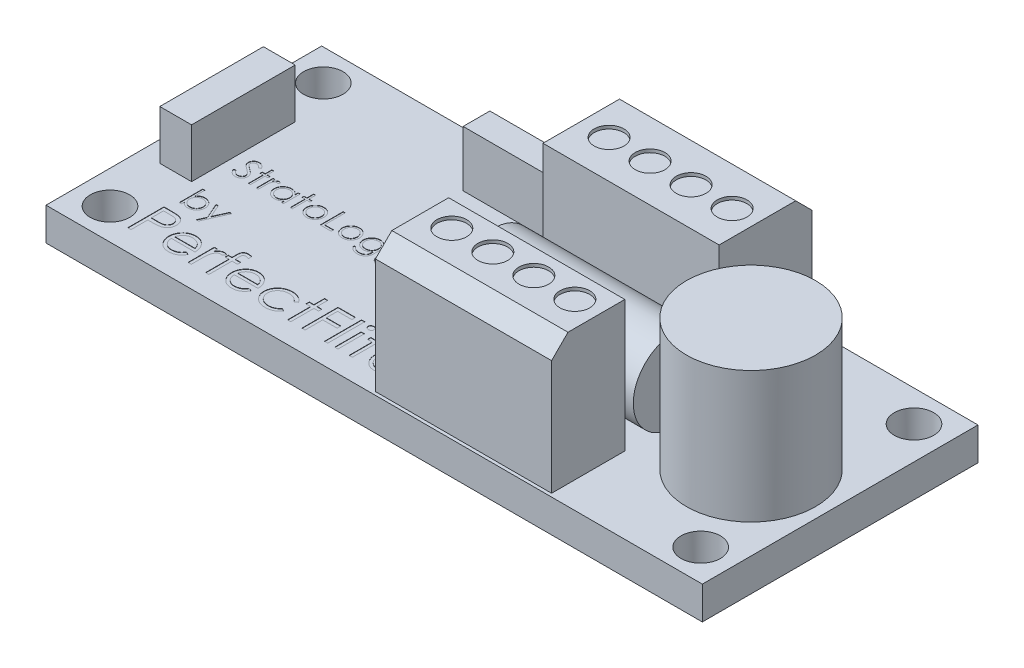
from build123d import *

# Parameters (mm, degrees)
SKETCH1_W               = 50.8
SKETCH1_H               = 21.336
BOSS_EXTRUDE1_DEPTH     = 1.27
SKETCH2_R               = 1.524
CUT_EXTRUDE1_DEPTH      = 1.27
SKETCH3_R               = 4.995433107
SKETCH3_W               = 13.634773203
SKETCH3_H               = 7.193148067
SKETCH3_H_2             = 5.921890413
BOSS_EXTRUDE2_DEPTH     = 11.43
SKETCH6_W               = 50.8
SKETCH6_H               = 21.336
BOSS_EXTRUDE3_DEPTH     = 2.54
CUT_EXTRUDE4_DEPTH      = 36.23808191
CUT_EXTRUDE4_DEPTH_BACK = 36.23808191
SKETCH2_5_R             = 1.524
CUT_EXTRUDE5_DEPTH      = 36.23808191
CUT_EXTRUDE5_DEPTH_BACK = 36.23808191
SKETCH2_7_R             = 1.524
SKETCH11_W              = 13.634773203
SKETCH11_H              = 10.16
CUT_EXTRUDE6_DEPTH      = 0.254
CHAMFER2_SIZE           = 1.27
SKETCH12_W              = 2.457483846
SKETCH12_H              = 8.019157812
BOSS_EXTRUDE4_DEPTH     = 3.81
SKETCH15_R              = 3.175
BOSS_EXTRUDE5_DEPTH     = 13.97
SKETCH16_W              = 6.661074635
SKETCH16_H              = 2.06946008
BOSS_EXTRUDE6_DEPTH     = 4.318
SKETCH17_R              = 1.151427788
CUT_EXTRUDE7_DEPTH      = 0.254
SKETCH19_W              = 0.25074359
SKETCH19_H              = 2.865641025
SKETCH19_W_2            = 0.250743589
SKETCH19_H_2            = 2.041769231
CUT_EXTRUDE8_DEPTH      = 0.0254


with BuildPart() as part:
    # Sketch1 → Boss-Extrude1 (new body)
    with BuildSketch(Plane(origin=(0, 0, 0), x_dir=(1, 0, 0), z_dir=(0, 1, 0))):
        with Locations((5.440516129, 1.978741935)):
            Rectangle(SKETCH1_W, SKETCH1_H)
    extrude(amount=BOSS_EXTRUDE1_DEPTH)

    # Sketch2 → Cut-Extrude1 (cut)
    with BuildSketch(Plane(origin=(0, 1.27, 0), x_dir=(1, 0, 0), z_dir=(0, 1, 0))):
        with Locations(Location((-17.419483871, 10.233741935, 0), (0, 0, 270))):
            Circle(SKETCH2_R)
        with Locations(Location((28.300516129, 10.233741935, 0), (0, 0, 270))):
            Circle(SKETCH2_R)
        with Locations(Location((28.300516129, -6.276258065, 0), (0, 0, 270))):
            Circle(SKETCH2_R)
        with Locations(Location((-17.419483871, -6.276258065, 0), (0, 0, 270))):
            Circle(SKETCH2_R)
    extrude(amount=-CUT_EXTRUDE1_DEPTH, mode=Mode.SUBTRACT)

    # Sketch3 → Boss-Extrude2 (add)
    with BuildSketch(Plane(origin=(0, 1.27, 0), x_dir=(1, 0, 0), z_dir=(0, 1, 0))):
        with Locations(Location((25.038142697, 0.882886592, 0), (0, 0, 270))):
            Circle(SKETCH3_R)
        with Locations((12.101212218, 8.129714869)):
            Rectangle(SKETCH3_W, SKETCH3_H)
        with Locations((12.101212218, -5.728312859)):
            Rectangle(SKETCH3_W, SKETCH3_H_2)
    extrude(amount=BOSS_EXTRUDE2_DEPTH)

    # Sketch6 → Boss-Extrude3 (add)
    with BuildSketch(Plane.XZ):
        with Locations((5.440516129, -1.978741935)):
            Rectangle(SKETCH6_W, SKETCH6_H)
    extrude(amount=-BOSS_EXTRUDE3_DEPTH)

    # Sketch2<5> → Cut-Extrude4 (cut, two sides: drawn at the far end of the back side and taken through both)
    with BuildSketch(Plane(origin=(0, 1.27, 0), x_dir=(1, 0, 0), z_dir=(0, 1, 0)).offset(-CUT_EXTRUDE4_DEPTH_BACK)):
        with Locations(Location((28.300516129, 10.233741935, 0), (0, 0, 270))):
            Circle(SKETCH2_5_R)
    extrude(amount=CUT_EXTRUDE4_DEPTH + CUT_EXTRUDE4_DEPTH_BACK, mode=Mode.SUBTRACT)

    # Sketch2<7> → Cut-Extrude5 (cut, two sides: drawn at the far end of the back side and taken through both)
    with BuildSketch(Plane(origin=(0, 1.27, 0), x_dir=(1, 0, 0), z_dir=(0, 1, 0)).offset(-CUT_EXTRUDE5_DEPTH_BACK)):
        with Locations(Location((-17.419483871, 10.233741935, 0), (0, 0, 270))):
            Circle(SKETCH2_7_R)
        with Locations(Location((28.300516129, -6.276258065, 0), (0, 0, 270))):
            Circle(SKETCH2_7_R)
        with Locations(Location((-17.419483871, -6.276258065, 0), (0, 0, 270))):
            Circle(SKETCH2_7_R)
    extrude(amount=CUT_EXTRUDE5_DEPTH + CUT_EXTRUDE5_DEPTH_BACK, mode=Mode.SUBTRACT)

    # Sketch11 → Cut-Extrude6 (cut)
    with BuildSketch(Plane.XY.offset(8.689258065)):
        with Locations((12.101212218, 7.62)):
            Rectangle(SKETCH11_W, SKETCH11_H)
    extrude(amount=-CUT_EXTRUDE6_DEPTH, mode=Mode.SUBTRACT)

    # Chamfer2
    chamfer2_edges = [part.edges().sort_by_distance(p)[0] for p in [
        (12.101212217, 12.7, 8.435258065),
        (12.101212217, 12.7, -11.726288902),
    ]]
    chamfer(chamfer2_edges, length=CHAMFER2_SIZE)

    # Sketch12 → Boss-Extrude4 (add)
    with BuildSketch(Plane(origin=(0, 2.54, 0), x_dir=(1, 0, 0), z_dir=(0, 1, 0))):
        with Locations((-17.129532875, 2.528442269)):
            Rectangle(SKETCH12_W, SKETCH12_H)
    extrude(amount=BOSS_EXTRUDE4_DEPTH)

    # Sketch15 → Boss-Extrude5 (add)
    with BuildSketch(Plane(origin=(5.08, 0, 0), x_dir=(0, 0, -1), z_dir=(1, 0, 0))):
        with Locations((0.933017889, 5.528359677)):
            Circle(SKETCH15_R)
    extrude(amount=BOSS_EXTRUDE5_DEPTH)

    # Sketch16 → Boss-Extrude6 (add)
    with BuildSketch(Plane(origin=(0, 2.54, 0), x_dir=(1, 0, 0), z_dir=(0, 1, 0))):
        with Locations((-1.446905702, 9.448199414)):
            Rectangle(SKETCH16_W, SKETCH16_H)
    extrude(amount=BOSS_EXTRUDE6_DEPTH)

    # Sketch17 → Cut-Extrude7 (cut)
    with BuildSketch(Plane(origin=(0, 12.7, 0), x_dir=(1, 0, 0), z_dir=(0, 1, 0))):
        with Locations(Location((7.44932206, 7.481703016, 0), (0, 0, 270))):
            Circle(SKETCH17_R)
        with Locations(Location((10.62432206, 7.481703016, 0), (0, 0, 270))):
            Circle(SKETCH17_R)
        with Locations(Location((13.79932206, 7.481703016, 0), (0, 0, 270))):
            Circle(SKETCH17_R)
        with Locations(Location((16.97432206, 7.481703016, 0), (0, 0, 270))):
            Circle(SKETCH17_R)
        with Locations(Location((7.44932206, -4.690853429, 0), (0, 0, 270))):
            Circle(SKETCH17_R)
        with Locations(Location((10.62432206, -4.690853429, 0), (0, 0, 270))):
            Circle(SKETCH17_R)
        with Locations(Location((13.79932206, -4.690853429, 0), (0, 0, 270))):
            Circle(SKETCH17_R)
        with Locations(Location((16.97432206, -4.690853429, 0), (0, 0, 270))):
            Circle(SKETCH17_R)
    extrude(amount=-CUT_EXTRUDE7_DEPTH, mode=Mode.SUBTRACT)

    # Sketch19 → Cut-Extrude8 (cut)
    # profile 1 of 29: a face of its own
    with BuildSketch(Plane(origin=(0, 2.54, 0), x_dir=(1, 0, 0), z_dir=(0, 1, 0))):
        with BuildLine():
            Line((-15.110834719, 0.940732692), (-14.960531033, 1.03084367))
            add(Edge.make_bspline(
                [(-14.960531033, 1.03084367), (-14.946551769, 1.007442962), (-14.919768037, 0.962608109), (-14.875088747, 0.902025025), (-14.828793228, 0.850533049), (-14.780538647, 0.808431733), (-14.730619545, 0.775285298), (-14.678710046, 0.751814564), (-14.624985078, 0.737176049), (-14.588422377, 0.735398005), (-14.570168854, 0.734510336)],
                knots=[0, 0, 0, 0, 1.272034388, 2.437168799, 3.508375237, 4.49857839, 5.41946034, 6.295179144, 7.148887113, 8, 8, 8, 8], degree=3))
            add(Edge.make_bspline(
                [(-14.570168854, 0.734510336), (-14.554579929, 0.73494451), (-14.523674848, 0.73580526), (-14.478177229, 0.744075908), (-14.433990473, 0.756782069), (-14.392025285, 0.774979102), (-14.352860713, 0.796995053), (-14.318516512, 0.823586911), (-14.288825886, 0.853358864), (-14.264538856, 0.886573252), (-14.245905398, 0.922294364), (-14.231583827, 0.958959747), (-14.22363613, 0.99714538), (-14.222438899, 1.022855495), (-14.221834719, 1.035830048)],
                knots=[0, 0, 0, 0, 1.095163259, 2.171163733, 3.241058638, 4.321873601, 5.38011039, 6.391990106, 7.366004449, 8.327778327, 9.272591725, 10.192022065, 11.087607919, 12, 12, 12, 12], degree=3))
            add(Edge.make_bspline(
                [(-14.221834719, 1.035830048), (-14.222583669, 1.050633599), (-14.224106175, 1.080727057), (-14.236974567, 1.12512608), (-14.257217984, 1.169064306), (-14.275893407, 1.196242949), (-14.285589126, 1.210353285)],
                knots=[0, 0, 0, 0, 0.938893495, 1.908633276, 2.914225137, 4, 4, 4, 4], degree=3))
            add(Edge.make_bspline(
                [(-14.285589126, 1.210353285), (-14.293549798, 1.220537071), (-14.310262233, 1.241916657), (-14.33899345, 1.273740437), (-14.372707436, 1.306566593), (-14.410250442, 1.341648594), (-14.452990051, 1.377354795), (-14.499587628, 1.41538788), (-14.551232869, 1.454301481), (-14.587453013, 1.480398745), (-14.606142011, 1.493864503)],
                knots=[0, 0, 0, 0, 0.722233717, 1.516239348, 2.393582979, 3.351407094, 4.387010283, 5.505090956, 6.712668013, 8, 8, 8, 8], degree=3))
            add(Edge.make_bspline(
                [(-14.606142011, 1.493864503), (-14.624848601, 1.507188625), (-14.660614177, 1.532663333), (-14.710631136, 1.570470869), (-14.755357724, 1.605037155), (-14.794595144, 1.636687593), (-14.828326139, 1.665426476), (-14.856816512, 1.690977829), (-14.879340499, 1.714032678), (-14.891865534, 1.72898888), (-14.897488966, 1.735703846)],
                knots=[0, 0, 0, 0, 1.452282411, 2.77665338, 3.964542531, 5.026858415, 5.96415736, 6.766646006, 7.446254459, 8, 8, 8, 8], degree=3))
            add(Edge.make_bspline(
                [(-14.897488966, 1.735703846), (-14.905349019, 1.746169173), (-14.920806868, 1.766750642), (-14.941211199, 1.79891967), (-14.958553894, 1.831849889), (-14.972149158, 1.865629788), (-14.983597557, 1.899785132), (-14.991297786, 1.934761565), (-14.996119416, 1.970402143), (-14.996613185, 1.994386601), (-14.99686036, 2.006392948)],
                knots=[0, 0, 0, 0, 1.068054152, 2.10047183, 3.106115577, 4.101338837, 5.06977816, 6.043150881, 7.020423561, 8, 8, 8, 8], degree=3))
            add(Edge.make_bspline(
                [(-14.99686036, 2.006392948), (-14.996197314, 2.025204074), (-14.994885394, 2.06242425), (-14.983790411, 2.116795912), (-14.966278181, 2.168706612), (-14.941744378, 2.217642422), (-14.910117643, 2.26232914), (-14.873518288, 2.303280791), (-14.829926053, 2.337707231), (-14.78209652, 2.367786957), (-14.729743883, 2.391330687), (-14.674884504, 2.409090865), (-14.617431192, 2.419153968), (-14.578516799, 2.420598092), (-14.558771418, 2.421330849)],
                knots=[0, 0, 0, 0, 1.005424448, 1.989358655, 2.955360095, 3.929531133, 4.905563448, 5.876582895, 6.856512386, 7.866279853, 8.892233794, 9.918561126, 10.94386622, 12, 12, 12, 12], degree=3))
            add(Edge.make_bspline(
                [(-14.558771418, 2.421330849), (-14.537819415, 2.420608193), (-14.496152568, 2.41917106), (-14.434862767, 2.406675514), (-14.375853123, 2.385999573), (-14.328383944, 2.362535735), (-14.291232502, 2.339100976), (-14.262899953, 2.317754905), (-14.234189088, 2.29318035), (-14.204868316, 2.265311853), (-14.175434461, 2.233893703), (-14.145450548, 2.199141073), (-14.114846459, 2.161266343), (-14.095158482, 2.134228296), (-14.085065488, 2.120367307)],
                knots=[0, 0, 0, 0, 1.286793592, 2.559021753, 3.825965368, 5.121522368, 5.803751409, 6.523245864, 7.299691795, 8.125521123, 9.008227632, 9.944561021, 10.946284179, 12, 12, 12, 12], degree=3))
            Line((-14.085065488, 2.120367307), (-14.229314287, 2.011023157))
            add(Edge.make_bspline(
                [(-14.229314287, 2.011023157), (-14.23802442, 2.022244212), (-14.254798101, 2.043853339), (-14.280263881, 2.074115568), (-14.304266194, 2.101759139), (-14.327913797, 2.125769824), (-14.349957762, 2.147462508), (-14.371353219, 2.166034865), (-14.391792269, 2.181668867), (-14.41755646, 2.198353395), (-14.449925061, 2.214892099), (-14.490557205, 2.228887031), (-14.533019033, 2.237297002), (-14.561939286, 2.238408957), (-14.576579912, 2.238971875)],
                knots=[0, 0, 0, 0, 1.181633172, 2.275549214, 3.290209073, 4.226197932, 5.078386478, 5.862611352, 6.581680152, 7.217281963, 8.414376989, 9.595101626, 10.782541182, 12, 12, 12, 12], degree=3))
            add(Edge.make_bspline(
                [(-14.576579912, 2.238971875), (-14.594947425, 2.238356331), (-14.630367444, 2.237169313), (-14.680654484, 2.224205161), (-14.725914198, 2.203792776), (-14.764802901, 2.175184767), (-14.797181285, 2.141290503), (-14.820602859, 2.102286844), (-14.834699942, 2.059217384), (-14.836420172, 2.029173422), (-14.837296258, 2.013872516)],
                knots=[0, 0, 0, 0, 1.14458467, 2.207223713, 3.21896685, 4.227309161, 5.202851033, 6.127160689, 7.046193047, 8, 8, 8, 8], degree=3))
            add(Edge.make_bspline(
                [(-14.837296258, 2.013872516), (-14.837096549, 2.004346765), (-14.836696806, 1.985279686), (-14.831121609, 1.957110364), (-14.82395915, 1.929012203), (-14.812609093, 1.901111531), (-14.796939679, 1.872920397), (-14.776363049, 1.843953354), (-14.750448287, 1.813955086), (-14.730597164, 1.79444414), (-14.72011637, 1.784142948)],
                knots=[0, 0, 0, 0, 0.858281714, 1.717966888, 2.583508476, 3.4729293, 4.427298488, 5.488583878, 6.674047936, 8, 8, 8, 8], degree=3))
            add(Edge.make_bspline(
                [(-14.72011637, 1.784142948), (-14.716224393, 1.780669739), (-14.706977946, 1.772418189), (-14.690073776, 1.758909311), (-14.667750834, 1.742245503), (-14.640592036, 1.721627146), (-14.608096616, 1.697709763), (-14.570261002, 1.670799168), (-14.527506943, 1.640021755), (-14.49716821, 1.618504124), (-14.481126386, 1.607126522)],
                knots=[0, 0, 0, 0, 0.420754252, 0.999615792, 1.744751191, 2.668019286, 3.750313428, 4.999500688, 6.413464383, 8, 8, 8, 8], degree=3))
            add(Edge.make_bspline(
                [(-14.481126386, 1.607126522), (-14.461829542, 1.593084712), (-14.424463878, 1.565894691), (-14.371297828, 1.525043526), (-14.323091773, 1.485090459), (-14.279676466, 1.446290635), (-14.240622996, 1.408938364), (-14.206364634, 1.372584268), (-14.176552308, 1.337488797), (-14.144457265, 1.292493929), (-14.111661893, 1.237233138), (-14.083497607, 1.169527793), (-14.065738767, 1.101559262), (-14.063416437, 1.055876429), (-14.062270617, 1.033336859)],
                knots=[0, 0, 0, 0, 1.163667725, 2.253281268, 3.268753668, 4.215851969, 5.092017293, 5.902905408, 6.650798638, 7.335211899, 8.59617414, 9.77448103, 10.901945474, 12, 12, 12, 12], degree=3))
            add(Edge.make_bspline(
                [(-14.062270617, 1.033336859), (-14.062604443, 1.017396649), (-14.063265612, 0.985825778), (-14.070865757, 0.939468199), (-14.082000947, 0.894443718), (-14.098783861, 0.851308872), (-14.119268026, 0.809274533), (-14.14526048, 0.76944332), (-14.175388784, 0.730933669), (-14.209949936, 0.694772455), (-14.247768455, 0.661576588), (-14.287739771, 0.632047025), (-14.32992931, 0.607425116), (-14.374108199, 0.587333289), (-14.420286586, 0.571619062), (-14.46844894, 0.560233324), (-14.518674652, 0.553245423), (-14.552812497, 0.55252012), (-14.570168854, 0.552151362)],
                knots=[0, 0, 0, 0, 0.983748083, 1.948392443, 2.894712957, 3.844097841, 4.80183111, 5.778335162, 6.776009319, 7.81870978, 8.863265674, 9.881300176, 10.883814829, 11.87499822, 12.874611388, 13.892143829, 14.928324115, 16, 16, 16, 16], degree=3))
            add(Edge.make_bspline(
                [(-14.570168854, 0.552151362), (-14.583598008, 0.552411042), (-14.61028719, 0.552927132), (-14.649763607, 0.557489623), (-14.688442518, 0.563944831), (-14.725838574, 0.574193259), (-14.762433579, 0.586627563), (-14.798068374, 0.601937836), (-14.832760229, 0.620285375), (-14.866703561, 0.641263247), (-14.899812042, 0.665676581), (-14.931775132, 0.694111117), (-14.963641558, 0.725782634), (-14.994470755, 0.7615512), (-15.024886313, 0.800838946), (-15.054288545, 0.844013451), (-15.083286057, 0.890839547), (-15.101480315, 0.923791011), (-15.110834719, 0.940732692)],
                knots=[0, 0, 0, 0, 0.915332311, 1.819136955, 2.706846663, 3.586547465, 4.459518054, 5.340707479, 6.227863349, 7.133153174, 8.059268498, 9.028702269, 10.047606654, 11.120612155, 12.245963614, 13.433783089, 14.680604001, 16, 16, 16, 16], degree=3))
        make_face()
    # profile 2 of 29: a face of its own
    with BuildSketch(Plane(origin=(0, 2.54, 0), x_dir=(1, 0, 0), z_dir=(0, 1, 0))):
        Polygon((-13.583578309, 2.421330849), (-13.424014206, 2.421330849), (-13.424014206, 1.897048798), (-13.196065488, 1.897048798), (-13.196065488, 1.737484695), (-13.424014206, 1.737484695), (-13.424014206, 0.597741105), (-13.583578309, 0.597741105), (-13.583578309, 1.737484695), (-13.811527027, 1.737484695), (-13.811527027, 1.897048798), (-13.583578309, 1.897048798), align=None)
    # profile 3 of 29: a face of its own
    with BuildSketch(Plane(origin=(0, 2.54, 0), x_dir=(1, 0, 0), z_dir=(0, 1, 0))):
        with BuildLine():
            Line((-12.968116771, 1.897048798), (-12.808552668, 1.897048798))
            Line((-12.808552668, 1.897048798), (-12.808552668, 1.705785577))
            add(Edge.make_bspline(
                [(-12.808552668, 1.705785577), (-12.796772779, 1.723593937), (-12.774243831, 1.757652289), (-12.736797663, 1.802696294), (-12.698441971, 1.839991138), (-12.658993136, 1.869710925), (-12.618161061, 1.89196799), (-12.57684189, 1.908271251), (-12.534385551, 1.917911727), (-12.505855293, 1.919198826), (-12.491561482, 1.91984367)],
                knots=[0, 0, 0, 0, 1.2804753, 2.448899062, 3.506932113, 4.484331642, 5.4025378, 6.288909075, 7.142734305, 8, 8, 8, 8], degree=3))
            add(Edge.make_bspline(
                [(-12.491561482, 1.91984367), (-12.480473708, 1.919238882), (-12.457659893, 1.917994492), (-12.423124737, 1.909251394), (-12.387542664, 1.895292558), (-12.364610331, 1.882165725), (-12.352655232, 1.875322436)],
                knots=[0, 0, 0, 0, 0.901110191, 1.854092781, 2.881294221, 4, 4, 4, 4], degree=3))
            Line((-12.352655232, 1.875322436), (-12.440273021, 1.737128525))
            add(Edge.make_bspline(
                [(-12.440273021, 1.737128525), (-12.447948403, 1.740552581), (-12.462517749, 1.747052093), (-12.483830669, 1.754744234), (-12.503480788, 1.759273519), (-12.515999715, 1.759959684), (-12.521835921, 1.760279567)],
                knots=[0, 0, 0, 0, 1.180555205, 2.24091978, 3.179933427, 4, 4, 4, 4], degree=3))
            add(Edge.make_bspline(
                [(-12.521835921, 1.760279567), (-12.534640434, 1.759426108), (-12.560757928, 1.757685299), (-12.599104054, 1.744000385), (-12.636313634, 1.721889563), (-12.665864838, 1.697367838), (-12.688746303, 1.673721557), (-12.705073537, 1.653072168), (-12.720050773, 1.629918224), (-12.734361245, 1.604655544), (-12.747399722, 1.576852782), (-12.759568694, 1.54678771), (-12.770571397, 1.514425505), (-12.776845321, 1.491879184), (-12.780059078, 1.480330048)],
                knots=[0, 0, 0, 0, 1.125678352, 2.296057538, 3.5422874, 4.923748041, 5.663163013, 6.437101912, 7.23742474, 8.08941207, 8.991984279, 9.93940061, 10.944477711, 12, 12, 12, 12], degree=3))
            add(Edge.make_bspline(
                [(-12.780059078, 1.480330048), (-12.782463134, 1.470029244), (-12.787787935, 1.447213745), (-12.792965236, 1.408936695), (-12.798080551, 1.363712676), (-12.801685633, 1.311415807), (-12.805027279, 1.252176685), (-12.806912001, 1.185905065), (-12.808488396, 1.112532922), (-12.808530594, 1.061237951), (-12.808552668, 1.034405368)],
                knots=[0, 0, 0, 0, 0.566838948, 1.255505196, 2.06880316, 3.007127437, 4.065329342, 5.249902469, 6.561414163, 8, 8, 8, 8], degree=3))
            Line((-12.808552668, 1.034405368), (-12.808552668, 0.597741105))
            Line((-12.808552668, 0.597741105), (-12.968116771, 0.597741105))
            Line((-12.968116771, 0.597741105), (-12.968116771, 1.897048798))
        make_face()
    # profile 4 of 29: a face of its own
    with BuildSketch(Plane(origin=(0, 2.54, 0), x_dir=(1, 0, 0), z_dir=(0, 1, 0))):
        with BuildLine():
            Line((-10.870988565, 1.897048798), (-10.870988565, 0.597741105))
            Line((-10.870988565, 0.597741105), (-11.030552668, 0.597741105))
            Line((-11.030552668, 0.597741105), (-11.030552668, 0.822484295))
            add(Edge.make_bspline(
                [(-11.030552668, 0.822484295), (-11.048545414, 0.802144181), (-11.083658483, 0.762450193), (-11.142302571, 0.71059245), (-11.204465605, 0.667728262), (-11.269845876, 0.633108105), (-11.338384344, 0.60710254), (-11.409929076, 0.588618372), (-11.484509258, 0.576734303), (-11.535437454, 0.575547604), (-11.561245777, 0.574946234)],
                knots=[0, 0, 0, 0, 1.074387032, 2.096679803, 3.090159297, 4.057316773, 5.018401886, 5.985159533, 6.978961417, 8, 8, 8, 8], degree=3))
            add(Edge.make_bspline(
                [(-11.561245777, 0.574946234), (-11.584191097, 0.575569231), (-11.629440286, 0.576797809), (-11.696003057, 0.586329059), (-11.760057919, 0.601635415), (-11.821665402, 0.622921067), (-11.880426852, 0.651156124), (-11.936845381, 0.684959078), (-11.990628709, 0.72521342), (-12.040957051, 0.771232138), (-12.087302907, 0.821216792), (-12.127974033, 0.874529129), (-12.161884598, 0.93093862), (-12.190241199, 0.989731062), (-12.212083342, 1.051359041), (-12.227309948, 1.115609442), (-12.236830095, 1.182406298), (-12.238058165, 1.227892376), (-12.238680873, 1.25095665)],
                knots=[0, 0, 0, 0, 1.033919861, 2.038935746, 3.024066025, 3.998881131, 4.97069526, 5.957263378, 6.95902576, 7.993208707, 9.027059324, 10.027763471, 11.009749337, 11.988697705, 12.965288445, 13.950418724, 14.960734635, 16, 16, 16, 16], degree=3))
            add(Edge.make_bspline(
                [(-12.238680873, 1.25095665), (-12.238044364, 1.273544212), (-12.236786019, 1.318198602), (-12.227411783, 1.383872181), (-12.211648031, 1.447127457), (-12.189525724, 1.507760784), (-12.161158011, 1.56584553), (-12.126650543, 1.621422775), (-12.086000827, 1.674645628), (-12.039136605, 1.724262612), (-11.988369741, 1.770094684), (-11.934060106, 1.809926479), (-11.877558679, 1.844326638), (-11.81798907, 1.871582604), (-11.756232981, 1.893634429), (-11.69174063, 1.908891177), (-11.624780348, 1.917881416), (-11.579319178, 1.9191833), (-11.556259399, 1.91984367)],
                knots=[0, 0, 0, 0, 1.020392517, 2.01726096, 2.990465484, 3.961182959, 4.928053699, 5.906110375, 6.912531644, 7.948652711, 8.985773172, 9.998621852, 10.987621588, 11.969261332, 12.953316658, 13.946091881, 14.958173133, 16, 16, 16, 16], degree=3))
            add(Edge.make_bspline(
                [(-11.556259399, 1.91984367), (-11.52974187, 1.919113292), (-11.477742249, 1.917681055), (-11.40168042, 1.90576199), (-11.329725025, 1.885625649), (-11.261320614, 1.85823556), (-11.196712826, 1.821838005), (-11.13651331, 1.775924985), (-11.080092044, 1.720786062), (-11.047386856, 1.678433876), (-11.030552668, 1.656634134)],
                knots=[0, 0, 0, 0, 1.038897134, 2.037228247, 3.008116434, 3.962042015, 4.918381754, 5.904844433, 6.921570401, 8, 8, 8, 8], degree=3))
            Line((-11.030552668, 1.656634134), (-11.030552668, 1.897048798))
            Line((-11.030552668, 1.897048798), (-10.870988565, 1.897048798))
        make_face()
        with BuildLine():
            add(Edge.make_bspline(
                [(-11.554122379, 1.760279567), (-11.577446863, 1.759449679), (-11.623485684, 1.757811612), (-11.691072037, 1.745023477), (-11.755747251, 1.723746103), (-11.817187857, 1.694646897), (-11.874423311, 1.658056299), (-11.925575696, 1.613798636), (-11.971063388, 1.563081433), (-12.009319986, 1.506133561), (-12.040506359, 1.44508309), (-12.062435211, 1.381265876), (-12.076897589, 1.315832947), (-12.078375117, 1.271452703), (-12.079116771, 1.249175801)],
                knots=[0, 0, 0, 0, 1.031046209, 2.035121221, 3.029706178, 4.034933723, 5.034054252, 6.02443088, 7.017295772, 8.038157696, 9.050218397, 10.03989886, 11.016116709, 12, 12, 12, 12], degree=3))
            add(Edge.make_bspline(
                [(-12.079116771, 1.249175801), (-12.078169405, 1.227032027), (-12.076278386, 1.182831274), (-12.062689034, 1.117309141), (-12.039890058, 1.053476887), (-12.00877909, 0.991876303), (-11.969822285, 0.93468358), (-11.924666849, 0.882999597), (-11.872876106, 0.838554887), (-11.815508933, 0.801350199), (-11.754240084, 0.771295639), (-11.689808447, 0.750383494), (-11.623425222, 0.736881981), (-11.578288237, 0.735304907), (-11.555547059, 0.734510336)],
                knots=[0, 0, 0, 0, 0.979072187, 1.954306742, 2.945804271, 3.96968567, 4.997920485, 5.998718438, 6.996577872, 8.005894225, 9.015743152, 10.005417472, 10.995077863, 12, 12, 12, 12], degree=3))
            add(Edge.make_bspline(
                [(-11.555547059, 0.734510336), (-11.532460236, 0.735353598), (-11.486542834, 0.737030762), (-11.41875597, 0.749873645), (-11.352972529, 0.771092194), (-11.290088617, 0.80050495), (-11.231508022, 0.836957687), (-11.1789311, 0.87963329), (-11.134472989, 0.929266507), (-11.096783143, 0.983813745), (-11.067230031, 1.043611439), (-11.045702993, 1.107281208), (-11.032975609, 1.174825268), (-11.031371482, 1.220984143), (-11.030552668, 1.244545593)],
                knots=[0, 0, 0, 0, 1.01762866, 2.023962475, 3.030623092, 4.058876274, 5.077231937, 6.066672613, 7.034107872, 8.005628644, 8.981990164, 9.965428785, 10.961468474, 12, 12, 12, 12], degree=3))
            add(Edge.make_bspline(
                [(-11.030552668, 1.244545593), (-11.031040173, 1.262497211), (-11.031999738, 1.297831676), (-11.039330468, 1.349712454), (-11.05099157, 1.399361187), (-11.067423425, 1.446830073), (-11.089008997, 1.491856661), (-11.115042862, 1.534764251), (-11.145982831, 1.575329683), (-11.18133084, 1.612994363), (-11.220022763, 1.647348606), (-11.26096479, 1.67801364), (-11.304641993, 1.703204736), (-11.350319848, 1.724053702), (-11.398077606, 1.74064455), (-11.448303881, 1.751712699), (-11.500464806, 1.759312542), (-11.536048202, 1.759953831), (-11.554122379, 1.760279567)],
                knots=[0, 0, 0, 0, 1.050140795, 2.067009409, 3.05949893, 4.030605086, 5.00011959, 5.97591094, 6.962425594, 7.979863591, 8.993523472, 9.986985069, 10.967611495, 11.937549037, 12.921786183, 13.919465291, 14.943216303, 16, 16, 16, 16], degree=3))
        make_face(mode=Mode.SUBTRACT)
    # profile 5 of 29: a face of its own
    with BuildSketch(Plane(origin=(0, 2.54, 0), x_dir=(1, 0, 0), z_dir=(0, 1, 0))):
        Polygon((-10.346706514, 2.421330849), (-10.187142412, 2.421330849), (-10.187142412, 1.897048798), (-9.959193694, 1.897048798), (-9.959193694, 1.737484695), (-10.187142412, 1.737484695), (-10.187142412, 0.597741105), (-10.346706514, 0.597741105), (-10.346706514, 1.737484695), (-10.574655232, 1.737484695), (-10.574655232, 1.897048798), (-10.346706514, 1.897048798), align=None)
    # profile 6 of 29: a face of its own
    with BuildSketch(Plane(origin=(0, 2.54, 0), x_dir=(1, 0, 0), z_dir=(0, 1, 0))):
        with BuildLine():
            add(Edge.make_bspline(
                [(-9.058083918, 1.91984367), (-9.033704351, 1.919324549), (-8.985901979, 1.91830668), (-8.915895573, 1.907427878), (-8.849070644, 1.890792216), (-8.785171259, 1.867794263), (-8.725015781, 1.836967832), (-8.667727989, 1.800183912), (-8.613464948, 1.756606355), (-8.580941249, 1.722896456), (-8.564432476, 1.705785577)],
                knots=[0, 0, 0, 0, 1.054011418, 2.066658804, 3.057071809, 4.030435133, 4.997543892, 5.974964718, 6.972108034, 8, 8, 8, 8], degree=3))
            add(Edge.make_bspline(
                [(-8.564432476, 1.705785577), (-8.550217643, 1.689420872), (-8.522063074, 1.657008164), (-8.485961689, 1.604452713), (-8.454861136, 1.550025542), (-8.429937152, 1.4930039), (-8.41028516, 1.433885567), (-8.396332586, 1.372467345), (-8.388033423, 1.308884873), (-8.386914316, 1.265702923), (-8.38634754, 1.243833253)],
                knots=[0, 0, 0, 0, 1.025258237, 2.030674902, 3.01204498, 3.988269485, 4.97094183, 5.956517959, 6.965070386, 8, 8, 8, 8], degree=3))
            add(Edge.make_bspline(
                [(-8.38634754, 1.243833253), (-8.386846059, 1.221836824), (-8.387831157, 1.178370853), (-8.397149714, 1.114353016), (-8.411643505, 1.052278046), (-8.432386079, 0.992405829), (-8.458983999, 0.934553353), (-8.491440468, 0.878973302), (-8.529983249, 0.825556018), (-8.57367328, 0.774755084), (-8.621959633, 0.727934647), (-8.674342636, 0.687127886), (-8.729792885, 0.652166552), (-8.789047709, 0.624004853), (-8.851565992, 0.601800325), (-8.917482583, 0.586204717), (-8.986695078, 0.576775381), (-9.033952907, 0.575564526), (-9.058083918, 0.574946234)],
                knots=[0, 0, 0, 0, 0.998656419, 1.973391657, 2.932242238, 3.890759089, 4.846373663, 5.82037756, 6.809684879, 7.83454468, 8.860553229, 9.859544525, 10.845671541, 11.83227036, 12.833544569, 13.85385346, 14.904124723, 16, 16, 16, 16], degree=3))
            add(Edge.make_bspline(
                [(-9.058083918, 0.574946234), (-9.082333155, 0.575566601), (-9.129826512, 0.576781623), (-9.199283311, 0.586168082), (-9.265318037, 0.601793138), (-9.327918165, 0.624077824), (-9.387427748, 0.652167452), (-9.443199288, 0.68702219), (-9.495624845, 0.727946749), (-9.543921413, 0.774751805), (-9.587608705, 0.825556863), (-9.626152193, 0.878973083), (-9.658608479, 0.93455341), (-9.685206446, 0.992405814), (-9.705949007, 1.05227805), (-9.720442802, 1.114353015), (-9.729761359, 1.178370854), (-9.730746456, 1.221836824), (-9.731244976, 1.243833253)],
                knots=[0, 0, 0, 0, 1.099876186, 2.154163076, 3.173186993, 4.173200201, 5.163417411, 6.152872554, 7.150605724, 8.17532212, 9.198891216, 10.186952605, 11.159729845, 12.11414092, 13.071450619, 14.029093627, 15.002601286, 16, 16, 16, 16], degree=3))
            add(Edge.make_bspline(
                [(-9.731244976, 1.243833253), (-9.730674334, 1.265584058), (-9.729544562, 1.308646915), (-9.721253743, 1.372109861), (-9.707355596, 1.433424135), (-9.687680047, 1.492314277), (-9.66252633, 1.549086038), (-9.631862796, 1.603647693), (-9.595393154, 1.655965495), (-9.567350563, 1.688336312), (-9.55316004, 1.704717067)],
                knots=[0, 0, 0, 0, 1.031353054, 2.041901799, 3.029428768, 4.008703097, 4.981709435, 5.96992636, 6.972712378, 8, 8, 8, 8], degree=3))
            add(Edge.make_bspline(
                [(-9.55316004, 1.704717067), (-9.536676156, 1.721976336), (-9.504257697, 1.755919726), (-9.449724543, 1.799370248), (-9.392577682, 1.836919614), (-9.331757419, 1.867133531), (-9.267910528, 1.890927498), (-9.200743152, 1.90747078), (-9.13049919, 1.918267484), (-9.082462903, 1.919313038), (-9.058083918, 1.91984367)],
                knots=[0, 0, 0, 0, 1.027980169, 2.021703884, 2.998553061, 3.971491411, 4.943284454, 5.930300938, 6.949603206, 8, 8, 8, 8], degree=3))
        make_face()
        with BuildLine():
            add(Edge.make_bspline(
                [(-9.058796258, 1.760279567), (-9.076036564, 1.759789554), (-9.110072122, 1.758822179), (-9.160170871, 1.751464355), (-9.208400469, 1.739807023), (-9.254852418, 1.723244163), (-9.299370069, 1.701857922), (-9.341996046, 1.675590075), (-9.382855725, 1.644788533), (-9.421149813, 1.609501496), (-9.456294428, 1.570954967), (-9.48701724, 1.529884), (-9.513141194, 1.486954777), (-9.534903995, 1.442122653), (-9.551112846, 1.394933307), (-9.562884742, 1.345921146), (-9.570235624, 1.294986315), (-9.571193904, 1.260360517), (-9.571680873, 1.242764743)],
                knots=[0, 0, 0, 0, 1.021534396, 2.016698045, 2.994645724, 3.958388632, 4.93408049, 5.916473867, 6.921342795, 7.962252576, 8.998418191, 10.008913653, 10.997312074, 11.973003931, 12.956656626, 13.948281152, 14.957379055, 16, 16, 16, 16], degree=3))
            add(Edge.make_bspline(
                [(-9.571680873, 1.242764743), (-9.570864607, 1.220030714), (-9.56924447, 1.174907916), (-9.55606937, 1.108455865), (-9.53402914, 1.044660284), (-9.504266802, 0.98389516), (-9.466976443, 0.927673643), (-9.423041013, 0.877548529), (-9.372932045, 0.834274137), (-9.317246863, 0.798368267), (-9.25712287, 0.769839111), (-9.193492659, 0.749621232), (-9.127127186, 0.736478412), (-9.081772575, 0.735172103), (-9.058796258, 0.734510336)],
                knots=[0, 0, 0, 0, 1.016792936, 2.018143844, 3.017858371, 4.030088057, 5.03801393, 6.028138512, 7.003788237, 7.991172063, 8.984598303, 9.972568034, 10.972917682, 12, 12, 12, 12], degree=3))
            add(Edge.make_bspline(
                [(-9.058796258, 0.734510336), (-9.035821262, 0.735175959), (-8.99046926, 0.736489879), (-8.924195998, 0.749555039), (-8.8607397, 0.769927699), (-8.800678155, 0.798336181), (-8.745018321, 0.834410488), (-8.694548967, 0.877304168), (-8.650988672, 0.927806404), (-8.613735201, 0.983969629), (-8.583485456, 1.04456608), (-8.561548389, 1.10846764), (-8.548341616, 1.174904917), (-8.546725755, 1.220029709), (-8.545911642, 1.242764743)],
                knots=[0, 0, 0, 0, 1.02726834, 2.027799167, 3.010890988, 4.004497153, 4.992059811, 5.971914811, 6.958719428, 7.966827853, 8.981595046, 9.981490638, 10.983022906, 12, 12, 12, 12], degree=3))
            add(Edge.make_bspline(
                [(-8.545911642, 1.242764743), (-8.546398443, 1.260360623), (-8.547356394, 1.294986627), (-8.554709676, 1.345919953), (-8.56647269, 1.394937684), (-8.582714271, 1.442106502), (-8.604382511, 1.487070854), (-8.631010241, 1.529757956), (-8.661607602, 1.571097241), (-8.6971763, 1.60937689), (-8.735430416, 1.644802289), (-8.776306655, 1.675602019), (-8.818869424, 1.701742477), (-8.863257744, 1.723427088), (-8.909715649, 1.739656336), (-8.95787767, 1.751531665), (-9.007762666, 1.758791085), (-9.04167626, 1.759780233), (-9.058796258, 1.760279567)],
                knots=[0, 0, 0, 0, 1.042956736, 2.052379634, 3.044323526, 4.02829302, 5.004299113, 5.996692471, 7.007513377, 8.048758398, 9.090003419, 10.095195979, 11.07790575, 12.047570684, 13.018257071, 13.989683339, 14.985167495, 16, 16, 16, 16], degree=3))
        make_face(mode=Mode.SUBTRACT)
    # profile 7 of 29: a face of its own
    with BuildSketch(Plane(origin=(0, 2.54, 0), x_dir=(1, 0, 0), z_dir=(0, 1, 0))):
        Polygon((-8.021629591, 2.375741105), (-7.862065488, 2.375741105), (-7.862065488, 0.78010008), (-7.178219335, 0.78010008), (-7.178219335, 0.597741105), (-8.021629591, 0.597741105), align=None)
    # profile 8 of 29: a face of its own
    with BuildSketch(Plane(origin=(0, 2.54, 0), x_dir=(1, 0, 0), z_dir=(0, 1, 0))):
        with BuildLine():
            add(Edge.make_bspline(
                [(-6.299904431, 1.91984367), (-6.275524864, 1.919324549), (-6.227722492, 1.91830668), (-6.157716086, 1.907427878), (-6.090891157, 1.890792216), (-6.026991771, 1.867794263), (-5.966836293, 1.836967832), (-5.909548501, 1.800183912), (-5.855285461, 1.756606355), (-5.822761762, 1.722896456), (-5.806252988, 1.705785577)],
                knots=[0, 0, 0, 0, 1.054011418, 2.066658804, 3.057071809, 4.030435133, 4.997543892, 5.974964718, 6.972108034, 8, 8, 8, 8], degree=3))
            add(Edge.make_bspline(
                [(-5.806252988, 1.705785577), (-5.792038156, 1.689420872), (-5.763883587, 1.657008164), (-5.727782201, 1.604452713), (-5.696681649, 1.550025542), (-5.671757665, 1.4930039), (-5.652105673, 1.433885567), (-5.638153099, 1.372467345), (-5.629853936, 1.308884873), (-5.628734829, 1.265702923), (-5.628168053, 1.243833253)],
                knots=[0, 0, 0, 0, 1.025258237, 2.030674902, 3.01204498, 3.988269485, 4.97094183, 5.956517959, 6.965070386, 8, 8, 8, 8], degree=3))
            add(Edge.make_bspline(
                [(-5.628168053, 1.243833253), (-5.628666572, 1.221836824), (-5.629651669, 1.178370853), (-5.638970227, 1.114353016), (-5.653464018, 1.052278046), (-5.674206592, 0.992405829), (-5.700804511, 0.934553353), (-5.733260981, 0.878973302), (-5.771803762, 0.825556018), (-5.815493793, 0.774755084), (-5.863780146, 0.727934647), (-5.916163149, 0.687127886), (-5.971613398, 0.652166552), (-6.030868222, 0.624004853), (-6.093386505, 0.601800325), (-6.159303096, 0.586204717), (-6.228515591, 0.576775381), (-6.27577342, 0.575564526), (-6.299904431, 0.574946234)],
                knots=[0, 0, 0, 0, 0.998656419, 1.973391657, 2.932242238, 3.890759089, 4.846373663, 5.82037756, 6.809684879, 7.83454468, 8.860553229, 9.859544525, 10.845671541, 11.83227036, 12.833544569, 13.85385346, 14.904124723, 16, 16, 16, 16], degree=3))
            add(Edge.make_bspline(
                [(-6.299904431, 0.574946234), (-6.324153668, 0.575566601), (-6.371647025, 0.576781623), (-6.441103824, 0.586168082), (-6.50713855, 0.601793138), (-6.569738678, 0.624077824), (-6.629248261, 0.652167452), (-6.685019801, 0.68702219), (-6.737445358, 0.727946749), (-6.785741926, 0.774751805), (-6.829429218, 0.825556863), (-6.867972706, 0.878973083), (-6.900428992, 0.93455341), (-6.927026959, 0.992405814), (-6.94776952, 1.05227805), (-6.962263315, 1.114353015), (-6.971581871, 1.178370854), (-6.972566969, 1.221836824), (-6.973065488, 1.243833253)],
                knots=[0, 0, 0, 0, 1.099876186, 2.154163076, 3.173186993, 4.173200201, 5.163417411, 6.152872554, 7.150605724, 8.17532212, 9.198891216, 10.186952605, 11.159729845, 12.11414092, 13.071450619, 14.029093627, 15.002601286, 16, 16, 16, 16], degree=3))
            add(Edge.make_bspline(
                [(-6.973065488, 1.243833253), (-6.972494847, 1.265584058), (-6.971365074, 1.308646915), (-6.963074256, 1.372109861), (-6.949176109, 1.433424135), (-6.92950056, 1.492314277), (-6.904346843, 1.549086038), (-6.873683308, 1.603647693), (-6.837213667, 1.655965495), (-6.809171076, 1.688336312), (-6.794980553, 1.704717067)],
                knots=[0, 0, 0, 0, 1.031353054, 2.041901799, 3.029428768, 4.008703097, 4.981709435, 5.96992636, 6.972712378, 8, 8, 8, 8], degree=3))
            add(Edge.make_bspline(
                [(-6.794980553, 1.704717067), (-6.778496668, 1.721976336), (-6.746078209, 1.755919726), (-6.691545056, 1.799370248), (-6.634398195, 1.836919614), (-6.573577932, 1.867133531), (-6.50973104, 1.890927498), (-6.442563665, 1.90747078), (-6.372319703, 1.918267484), (-6.324283416, 1.919313038), (-6.299904431, 1.91984367)],
                knots=[0, 0, 0, 0, 1.027980169, 2.021703884, 2.998553061, 3.971491411, 4.943284454, 5.930300938, 6.949603206, 8, 8, 8, 8], degree=3))
        make_face()
        with BuildLine():
            add(Edge.make_bspline(
                [(-6.300616771, 1.760279567), (-6.317857077, 1.759789554), (-6.351892634, 1.758822179), (-6.401991383, 1.751464355), (-6.450220982, 1.739807023), (-6.49667293, 1.723244163), (-6.541190582, 1.701857922), (-6.583816558, 1.675590075), (-6.624676238, 1.644788533), (-6.662970326, 1.609501496), (-6.698114941, 1.570954967), (-6.728837753, 1.529884), (-6.754961707, 1.486954777), (-6.776724508, 1.442122653), (-6.792933359, 1.394933307), (-6.804705255, 1.345921146), (-6.812056137, 1.294986315), (-6.813014417, 1.260360517), (-6.813501386, 1.242764743)],
                knots=[0, 0, 0, 0, 1.021534396, 2.016698045, 2.994645724, 3.958388632, 4.93408049, 5.916473867, 6.921342795, 7.962252576, 8.998418191, 10.008913653, 10.997312074, 11.973003931, 12.956656626, 13.948281152, 14.957379055, 16, 16, 16, 16], degree=3))
            add(Edge.make_bspline(
                [(-6.813501386, 1.242764743), (-6.812685119, 1.220030714), (-6.811064983, 1.174907916), (-6.797889883, 1.108455865), (-6.775849653, 1.044660284), (-6.746087315, 0.98389516), (-6.708796956, 0.927673643), (-6.664861526, 0.877548529), (-6.614752558, 0.834274137), (-6.559067376, 0.798368267), (-6.498943383, 0.769839111), (-6.435313171, 0.749621232), (-6.368947699, 0.736478412), (-6.323593087, 0.735172103), (-6.300616771, 0.734510336)],
                knots=[0, 0, 0, 0, 1.016792936, 2.018143844, 3.017858371, 4.030088057, 5.03801393, 6.028138512, 7.003788237, 7.991172063, 8.984598303, 9.972568034, 10.972917682, 12, 12, 12, 12], degree=3))
            add(Edge.make_bspline(
                [(-6.300616771, 0.734510336), (-6.277641775, 0.735175959), (-6.232289772, 0.736489879), (-6.166016511, 0.749555039), (-6.102560213, 0.769927699), (-6.042498668, 0.798336181), (-5.986838833, 0.834410488), (-5.93636948, 0.877304168), (-5.892809185, 0.927806404), (-5.855555714, 0.983969629), (-5.825305969, 1.04456608), (-5.803368902, 1.10846764), (-5.790162129, 1.174904917), (-5.788546268, 1.220029709), (-5.787732155, 1.242764743)],
                knots=[0, 0, 0, 0, 1.02726834, 2.027799167, 3.010890988, 4.004497153, 4.992059811, 5.971914811, 6.958719428, 7.966827853, 8.981595046, 9.981490638, 10.983022906, 12, 12, 12, 12], degree=3))
            add(Edge.make_bspline(
                [(-5.787732155, 1.242764743), (-5.788218956, 1.260360623), (-5.789176907, 1.294986627), (-5.796530189, 1.345919953), (-5.808293203, 1.394937684), (-5.824534784, 1.442106502), (-5.846203023, 1.487070854), (-5.872830754, 1.529757956), (-5.903428115, 1.571097241), (-5.938996813, 1.60937689), (-5.977250929, 1.644802289), (-6.018127168, 1.675602019), (-6.060689937, 1.701742477), (-6.105078257, 1.723427088), (-6.151536161, 1.739656336), (-6.199698183, 1.751531665), (-6.249583178, 1.758791085), (-6.283496772, 1.759780233), (-6.300616771, 1.760279567)],
                knots=[0, 0, 0, 0, 1.042956736, 2.052379634, 3.044323526, 4.02829302, 5.004299113, 5.996692471, 7.007513377, 8.048758398, 9.090003419, 10.095195979, 11.07790575, 12.047570684, 13.018257071, 13.989683339, 14.985167495, 16, 16, 16, 16], degree=3))
        make_face(mode=Mode.SUBTRACT)
    # profile 9 of 29: a face of its own
    with BuildSketch(Plane(origin=(0, 2.54, 0), x_dir=(1, 0, 0), z_dir=(0, 1, 0))):
        with BuildLine():
            Line((-4.169296258, 1.897048798), (-4.009732155, 1.897048798))
            Line((-4.009732155, 1.897048798), (-4.009732155, 0.865937019))
            add(Edge.make_bspline(
                [(-4.009732155, 0.865937019), (-4.009872893, 0.843972321), (-4.01014455, 0.801575163), (-4.012100844, 0.740270597), (-4.016226148, 0.683645825), (-4.020904158, 0.631442598), (-4.02763349, 0.583902886), (-4.035851084, 0.540884834), (-4.045114809, 0.50234716), (-4.05325308, 0.478610941), (-4.057102748, 0.467382932)],
                knots=[0, 0, 0, 0, 1.307562039, 2.523909702, 3.650326591, 4.686913197, 5.643429486, 6.506965704, 7.293745905, 8, 8, 8, 8], degree=3))
            add(Edge.make_bspline(
                [(-4.057102748, 0.467382932), (-4.062786881, 0.452788132), (-4.073985196, 0.424034907), (-4.094958298, 0.383275872), (-4.118445121, 0.344898306), (-4.14527095, 0.309116081), (-4.175314479, 0.276108825), (-4.207867877, 0.245159434), (-4.243565134, 0.216922677), (-4.28238584, 0.191885746), (-4.323435101, 0.169337122), (-4.366689321, 0.149806266), (-4.411904592, 0.132794949), (-4.459505661, 0.120052889), (-4.50874622, 0.109011651), (-4.560205315, 0.101826151), (-4.613582296, 0.096935605), (-4.649876549, 0.096483367), (-4.668290248, 0.096253926)],
                knots=[0, 0, 0, 0, 0.981931301, 1.934503488, 2.87077864, 3.801706999, 4.735015492, 5.667491629, 6.616593066, 7.585388521, 8.561939025, 9.551802639, 10.560317337, 11.588439944, 12.640189604, 13.723962949, 14.845264515, 16, 16, 16, 16], degree=3))
            add(Edge.make_bspline(
                [(-4.668290248, 0.096253926), (-4.695155693, 0.096689021), (-4.747631126, 0.097538878), (-4.824138462, 0.107440263), (-4.8968001, 0.121437884), (-4.964655924, 0.142624241), (-5.027277133, 0.168551032), (-5.084236062, 0.198317268), (-5.135021384, 0.232449437), (-5.18080421, 0.271311742), (-5.222125738, 0.317521293), (-5.261001601, 0.371978306), (-5.29842136, 0.435512285), (-5.320351028, 0.482142984), (-5.331834719, 0.506561618)],
                knots=[0, 0, 0, 0, 1.157897085, 2.2616841, 3.32207898, 4.345638746, 5.321241055, 6.241986252, 7.112515963, 7.955008012, 8.825025602, 9.77857164, 10.836726669, 12, 12, 12, 12], degree=3))
            Line((-5.331834719, 0.506561618), (-5.172270617, 0.506561618))
            add(Edge.make_bspline(
                [(-5.172270617, 0.506561618), (-5.159437414, 0.486187833), (-5.134350084, 0.446359593), (-5.087437056, 0.39479091), (-5.036024242, 0.3507202), (-4.978376563, 0.315205527), (-4.914254153, 0.288428953), (-4.843618437, 0.269340702), (-4.765894629, 0.257912599), (-4.711783376, 0.256535261), (-4.683605553, 0.255818029)],
                knots=[0, 0, 0, 0, 0.997731894, 1.950442991, 2.880492273, 3.800895997, 4.748200782, 5.754801363, 6.83083817, 8, 8, 8, 8], degree=3))
            add(Edge.make_bspline(
                [(-4.683605553, 0.255818029), (-4.655783972, 0.256544544), (-4.60214675, 0.257945193), (-4.525016516, 0.269345803), (-4.454610288, 0.288433107), (-4.391333706, 0.315158167), (-4.335933376, 0.347898974), (-4.288175284, 0.384475012), (-4.249493788, 0.425714961), (-4.223477601, 0.463704119), (-4.207305616, 0.497549177), (-4.197007319, 0.526684295), (-4.188638543, 0.559629557), (-4.181638385, 0.596274511), (-4.175861961, 0.636671513), (-4.172202897, 0.68091293), (-4.169558345, 0.728898215), (-4.16938564, 0.762168729), (-4.169296258, 0.77938774)],
                knots=[0, 0, 0, 0, 1.570740765, 3.028230971, 4.391408896, 5.680370741, 6.894727393, 8.017376726, 9.065722033, 10.075533815, 10.603371122, 11.180248986, 11.817768598, 12.521299649, 13.286540596, 14.121245857, 15.027658897, 16, 16, 16, 16], degree=3))
            Line((-4.169296258, 0.77938774), (-4.169296258, 0.846703846))
            add(Edge.make_bspline(
                [(-4.169296258, 0.846703846), (-4.185491865, 0.82742941), (-4.217598205, 0.789219571), (-4.273045047, 0.739150259), (-4.33360724, 0.696028105), (-4.39918168, 0.660661839), (-4.468162107, 0.632375675), (-4.5398014, 0.612592651), (-4.613457364, 0.599811422), (-4.663369456, 0.598436105), (-4.688591931, 0.597741105)],
                knots=[0, 0, 0, 0, 1.012485704, 2.007162095, 2.997754123, 3.998611389, 4.999708251, 5.992315798, 6.98544096, 8, 8, 8, 8], degree=3))
            add(Edge.make_bspline(
                [(-4.688591931, 0.597741105), (-4.703443956, 0.598002739), (-4.732972247, 0.59852291), (-4.776840458, 0.603073969), (-4.820061321, 0.60967733), (-4.862534035, 0.619370701), (-4.904319886, 0.631812498), (-4.945349823, 0.647365801), (-4.985956054, 0.664950281), (-5.025400475, 0.685662865), (-5.06329023, 0.708706917), (-5.099339528, 0.733669474), (-5.133359546, 0.760419884), (-5.165026482, 0.789221929), (-5.194298799, 0.820033924), (-5.221570204, 0.852527409), (-5.246389737, 0.887156114), (-5.269266698, 0.923288608), (-5.289107934, 0.961165557), (-5.306524395, 0.99996563), (-5.321667573, 1.039605863), (-5.333740397, 1.080218971), (-5.342961162, 1.121779349), (-5.349824357, 1.164218913), (-5.353717127, 1.20766835), (-5.354324148, 1.236939995), (-5.354629591, 1.25166899)],
                knots=[0, 0, 0, 0, 1.028754217, 2.045334182, 3.052854819, 4.056607503, 5.061168794, 6.071104265, 7.095078842, 8.125279047, 9.155117945, 10.165957491, 11.161587969, 12.151493252, 13.128948131, 14.104219989, 15.088194871, 16.07871515, 17.064853787, 18.047899887, 19.02414258, 20.002704429, 20.980574569, 21.971845993, 22.979467364, 24, 24, 24, 24], degree=3))
            add(Edge.make_bspline(
                [(-5.354629591, 1.25166899), (-5.354365855, 1.266402563), (-5.353839403, 1.295812643), (-5.349292306, 1.339439371), (-5.342806065, 1.382481924), (-5.332540519, 1.424496644), (-5.320184677, 1.465962018), (-5.304881902, 1.50657177), (-5.286482773, 1.546338268), (-5.26564982, 1.585290962), (-5.242239101, 1.622907151), (-5.216568601, 1.658633087), (-5.188607328, 1.692205878), (-5.158741035, 1.723964221), (-5.126605048, 1.753601699), (-5.092215992, 1.781046381), (-5.055912849, 1.806758307), (-5.017583106, 1.830182866), (-4.977818193, 1.850900247), (-4.937628373, 1.869804246), (-4.89648127, 1.884807579), (-4.85514402, 1.898027313), (-4.812888623, 1.907392393), (-4.770233187, 1.914617291), (-4.727031679, 1.91901897), (-4.698099609, 1.919568415), (-4.683605553, 1.91984367)],
                knots=[0, 0, 0, 0, 1.008818848, 2.013730394, 3.001654427, 3.987803273, 4.973046549, 5.963777569, 6.957074694, 7.972068341, 8.987420212, 9.989399531, 10.982630087, 11.977756091, 12.973280677, 13.973972381, 14.989194003, 16.018387222, 17.047741039, 18.059210846, 19.057554164, 20.045176975, 21.029480261, 22.018708529, 23.007435371, 24, 24, 24, 24], degree=3))
            add(Edge.make_bspline(
                [(-4.683605553, 1.91984367), (-4.659703676, 1.91915448), (-4.612504813, 1.917793541), (-4.543045463, 1.907114799), (-4.476018806, 1.89008968), (-4.411046614, 1.86569774), (-4.347599623, 1.832398321), (-4.285886942, 1.788536103), (-4.225730022, 1.73371765), (-4.188606484, 1.691679195), (-4.169296258, 1.66981242)],
                knots=[0, 0, 0, 0, 0.96728863, 1.910097829, 2.838038873, 3.762875196, 4.71315279, 5.730631239, 6.819562287, 8, 8, 8, 8], degree=3))
            Line((-4.169296258, 1.66981242), (-4.169296258, 1.897048798))
        make_face()
        with BuildLine():
            add(Edge.make_bspline(
                [(-4.670783437, 1.760279567), (-4.694116235, 1.759486546), (-4.740310226, 1.757916532), (-4.808020704, 1.744513097), (-4.873388587, 1.72350938), (-4.935164144, 1.693464932), (-4.993028956, 1.656841059), (-5.044374965, 1.612472193), (-5.089284662, 1.561801125), (-5.127274395, 1.505285999), (-5.157516329, 1.444314683), (-5.178925186, 1.38004723), (-5.192768198, 1.313522094), (-5.194296085, 1.268120812), (-5.195065488, 1.245257932)],
                knots=[0, 0, 0, 0, 1.026226791, 2.031711442, 3.026614839, 4.04107745, 5.047145931, 6.032893242, 7.017642609, 8.019221815, 9.021877557, 10.003543541, 10.994637589, 12, 12, 12, 12], degree=3))
            add(Edge.make_bspline(
                [(-5.195065488, 1.245257932), (-5.194696804, 1.22801983), (-5.193971709, 1.194117523), (-5.187000132, 1.144365073), (-5.175732202, 1.096978674), (-5.159762101, 1.051955459), (-5.139974132, 1.009037183), (-5.115086007, 0.968519492), (-5.085799314, 0.930366302), (-5.052343278, 0.894859803), (-5.015474476, 0.862520031), (-4.975485123, 0.834103507), (-4.932429456, 0.81086214), (-4.887366396, 0.790775395), (-4.839202532, 0.776104828), (-4.788631597, 0.764909129), (-4.735295815, 0.75850388), (-4.698937371, 0.757709979), (-4.680400024, 0.757305208)],
                knots=[0, 0, 0, 0, 1.039728707, 2.044842319, 3.024901384, 3.974314358, 4.923051295, 5.871625912, 6.837440708, 7.820715446, 8.810779094, 9.792721783, 10.773906224, 11.758876063, 12.764959493, 13.806266761, 14.881525401, 16, 16, 16, 16], degree=3))
            add(Edge.make_bspline(
                [(-4.680400024, 0.757305208), (-4.661622435, 0.757695153), (-4.624903058, 0.758457688), (-4.571273022, 0.765012665), (-4.52045639, 0.775590229), (-4.472499756, 0.790608246), (-4.427222051, 0.809770895), (-4.385131907, 0.834021097), (-4.345326831, 0.861638228), (-4.309077775, 0.893851531), (-4.276299499, 0.929353109), (-4.24773427, 0.967983915), (-4.223393729, 1.009162659), (-4.203237473, 1.052884698), (-4.187849541, 1.099489813), (-4.177527538, 1.148861498), (-4.170310511, 1.200763217), (-4.169639481, 1.236327594), (-4.169296258, 1.254518349)],
                knots=[0, 0, 0, 0, 1.121943988, 2.193949579, 3.223793937, 4.220241907, 5.192961521, 6.155822191, 7.11847367, 8.083710714, 9.04790392, 10.001595906, 10.949595423, 11.902125208, 12.873731292, 13.87582262, 14.913508608, 16, 16, 16, 16], degree=3))
            add(Edge.make_bspline(
                [(-4.169296258, 1.254518349), (-4.169976758, 1.278200219), (-4.171306217, 1.324466271), (-4.183852374, 1.391881309), (-4.20408104, 1.455263795), (-4.23245119, 1.514413271), (-4.268002051, 1.568703002), (-4.310821802, 1.617127515), (-4.360171986, 1.65974915), (-4.415910813, 1.695257432), (-4.475878915, 1.723941873), (-4.538627682, 1.745461653), (-4.604063957, 1.757650765), (-4.648415613, 1.759398257), (-4.670783437, 1.760279567)],
                knots=[0, 0, 0, 0, 1.070913519, 2.092188694, 3.091357305, 4.074328408, 5.051968682, 6.018948707, 6.99050112, 7.9935919, 9.000589572, 9.992915277, 10.987769056, 12, 12, 12, 12], degree=3))
        make_face(mode=Mode.SUBTRACT)
    # profile 10 of 29: a face of its own
    with BuildSketch(Plane(origin=(0, 2.54, 0), x_dir=(1, 0, 0), z_dir=(0, 1, 0))):
        with BuildLine():
            Line((-2.505270617, 1.897048798), (-2.345706514, 1.897048798))
            Line((-2.345706514, 1.897048798), (-2.345706514, 0.865937019))
            add(Edge.make_bspline(
                [(-2.345706514, 0.865937019), (-2.345847252, 0.843972321), (-2.346118909, 0.801575163), (-2.348075203, 0.740270597), (-2.352200507, 0.683645825), (-2.356878517, 0.631442598), (-2.363607849, 0.583902886), (-2.371825443, 0.540884834), (-2.381089168, 0.50234716), (-2.389227439, 0.478610941), (-2.393077107, 0.467382932)],
                knots=[0, 0, 0, 0, 1.307562039, 2.523909702, 3.650326591, 4.686913197, 5.643429486, 6.506965704, 7.293745905, 8, 8, 8, 8], degree=3))
            add(Edge.make_bspline(
                [(-2.393077107, 0.467382932), (-2.39876124, 0.452788132), (-2.409959555, 0.424034907), (-2.430932657, 0.383275872), (-2.45441948, 0.344898306), (-2.481245309, 0.309116081), (-2.511288838, 0.276108825), (-2.543842236, 0.245159434), (-2.579539493, 0.216922677), (-2.618360199, 0.191885746), (-2.65940946, 0.169337122), (-2.70266368, 0.149806266), (-2.747878951, 0.132794949), (-2.79548002, 0.120052889), (-2.844720579, 0.109011651), (-2.896179674, 0.101826151), (-2.949556655, 0.096935605), (-2.985850908, 0.096483367), (-3.004264607, 0.096253926)],
                knots=[0, 0, 0, 0, 0.981931301, 1.934503488, 2.87077864, 3.801706999, 4.735015492, 5.667491629, 6.616593066, 7.585388521, 8.561939025, 9.551802639, 10.560317337, 11.588439944, 12.640189604, 13.723962949, 14.845264515, 16, 16, 16, 16], degree=3))
            add(Edge.make_bspline(
                [(-3.004264607, 0.096253926), (-3.031130052, 0.096689021), (-3.083605485, 0.097538878), (-3.160112821, 0.107440263), (-3.232774459, 0.121437884), (-3.300630283, 0.142624241), (-3.363251492, 0.168551032), (-3.420210421, 0.198317268), (-3.470995743, 0.232449437), (-3.516778569, 0.271311742), (-3.558100097, 0.317521293), (-3.59697596, 0.371978306), (-3.634395719, 0.435512285), (-3.656325387, 0.482142984), (-3.667809078, 0.506561618)],
                knots=[0, 0, 0, 0, 1.157897085, 2.2616841, 3.32207898, 4.345638746, 5.321241055, 6.241986252, 7.112515963, 7.955008012, 8.825025602, 9.77857164, 10.836726669, 12, 12, 12, 12], degree=3))
            Line((-3.667809078, 0.506561618), (-3.508244976, 0.506561618))
            add(Edge.make_bspline(
                [(-3.508244976, 0.506561618), (-3.495411773, 0.486187833), (-3.470324443, 0.446359593), (-3.423411415, 0.39479091), (-3.371998601, 0.3507202), (-3.314350922, 0.315205527), (-3.250228512, 0.288428953), (-3.179592796, 0.269340702), (-3.101868988, 0.257912599), (-3.047757735, 0.256535261), (-3.019579912, 0.255818029)],
                knots=[0, 0, 0, 0, 0.997731894, 1.950442991, 2.880492273, 3.800895997, 4.748200782, 5.754801363, 6.83083817, 8, 8, 8, 8], degree=3))
            add(Edge.make_bspline(
                [(-3.019579912, 0.255818029), (-2.991758331, 0.256544544), (-2.938121109, 0.257945193), (-2.860990875, 0.269345803), (-2.790584647, 0.288433107), (-2.727308065, 0.315158167), (-2.671907735, 0.347898974), (-2.624149643, 0.384475012), (-2.585468147, 0.425714961), (-2.55945196, 0.463704119), (-2.543279975, 0.497549177), (-2.532981678, 0.526684295), (-2.524612902, 0.559629557), (-2.517612744, 0.596274511), (-2.51183632, 0.636671513), (-2.508177256, 0.68091293), (-2.505532704, 0.728898215), (-2.505359999, 0.762168729), (-2.505270617, 0.77938774)],
                knots=[0, 0, 0, 0, 1.570740765, 3.028230971, 4.391408896, 5.680370741, 6.894727393, 8.017376726, 9.065722033, 10.075533815, 10.603371122, 11.180248986, 11.817768598, 12.521299649, 13.286540596, 14.121245857, 15.027658897, 16, 16, 16, 16], degree=3))
            Line((-2.505270617, 0.77938774), (-2.505270617, 0.846703846))
            add(Edge.make_bspline(
                [(-2.505270617, 0.846703846), (-2.521466224, 0.82742941), (-2.553572564, 0.789219571), (-2.609019406, 0.739150259), (-2.669581599, 0.696028105), (-2.735156039, 0.660661839), (-2.804136466, 0.632375675), (-2.875775759, 0.612592651), (-2.949431723, 0.599811422), (-2.999343815, 0.598436105), (-3.02456629, 0.597741105)],
                knots=[0, 0, 0, 0, 1.012485704, 2.007162095, 2.997754123, 3.998611389, 4.999708251, 5.992315798, 6.98544096, 8, 8, 8, 8], degree=3))
            add(Edge.make_bspline(
                [(-3.02456629, 0.597741105), (-3.039418315, 0.598002739), (-3.068946606, 0.59852291), (-3.112814817, 0.603073969), (-3.15603568, 0.60967733), (-3.198508394, 0.619370701), (-3.240294245, 0.631812498), (-3.281324182, 0.647365801), (-3.321930413, 0.664950281), (-3.361374834, 0.685662865), (-3.399264589, 0.708706917), (-3.435313887, 0.733669474), (-3.469333905, 0.760419884), (-3.501000841, 0.789221929), (-3.530273158, 0.820033924), (-3.557544563, 0.852527409), (-3.582364096, 0.887156114), (-3.605241057, 0.923288608), (-3.625082293, 0.961165557), (-3.642498754, 0.99996563), (-3.657641932, 1.039605863), (-3.669714756, 1.080218971), (-3.678935521, 1.121779349), (-3.685798716, 1.164218913), (-3.689691486, 1.20766835), (-3.690298507, 1.236939995), (-3.69060395, 1.25166899)],
                knots=[0, 0, 0, 0, 1.028754217, 2.045334182, 3.052854819, 4.056607503, 5.061168794, 6.071104265, 7.095078842, 8.125279047, 9.155117945, 10.165957491, 11.161587969, 12.151493252, 13.128948131, 14.104219989, 15.088194871, 16.07871515, 17.064853787, 18.047899887, 19.02414258, 20.002704429, 20.980574569, 21.971845993, 22.979467364, 24, 24, 24, 24], degree=3))
            add(Edge.make_bspline(
                [(-3.69060395, 1.25166899), (-3.690340214, 1.266402563), (-3.689813762, 1.295812643), (-3.685266665, 1.339439371), (-3.678780424, 1.382481924), (-3.668514878, 1.424496644), (-3.656159036, 1.465962018), (-3.640856261, 1.50657177), (-3.622457132, 1.546338268), (-3.601624179, 1.585290962), (-3.57821346, 1.622907151), (-3.55254296, 1.658633087), (-3.524581687, 1.692205878), (-3.494715394, 1.723964221), (-3.462579407, 1.753601699), (-3.428190351, 1.781046381), (-3.391887208, 1.806758307), (-3.353557465, 1.830182866), (-3.313792552, 1.850900247), (-3.273602732, 1.869804246), (-3.232455629, 1.884807579), (-3.191118379, 1.898027313), (-3.148862982, 1.907392393), (-3.106207546, 1.914617291), (-3.063006038, 1.91901897), (-3.034073968, 1.919568415), (-3.019579912, 1.91984367)],
                knots=[0, 0, 0, 0, 1.008818848, 2.013730394, 3.001654427, 3.987803273, 4.973046549, 5.963777569, 6.957074694, 7.972068341, 8.987420212, 9.989399531, 10.982630087, 11.977756091, 12.973280677, 13.973972381, 14.989194003, 16.018387222, 17.047741039, 18.059210846, 19.057554164, 20.045176975, 21.029480261, 22.018708529, 23.007435371, 24, 24, 24, 24], degree=3))
            add(Edge.make_bspline(
                [(-3.019579912, 1.91984367), (-2.995678035, 1.91915448), (-2.948479172, 1.917793541), (-2.879019822, 1.907114799), (-2.811993165, 1.89008968), (-2.747020973, 1.86569774), (-2.683573982, 1.832398321), (-2.621861301, 1.788536103), (-2.561704381, 1.73371765), (-2.524580843, 1.691679195), (-2.505270617, 1.66981242)],
                knots=[0, 0, 0, 0, 0.96728863, 1.910097829, 2.838038873, 3.762875196, 4.71315279, 5.730631239, 6.819562287, 8, 8, 8, 8], degree=3))
            Line((-2.505270617, 1.66981242), (-2.505270617, 1.897048798))
        make_face()
        with BuildLine():
            add(Edge.make_bspline(
                [(-3.006757796, 1.760279567), (-3.030090594, 1.759486546), (-3.076284585, 1.757916532), (-3.143995063, 1.744513097), (-3.209362946, 1.72350938), (-3.271138503, 1.693464932), (-3.329003315, 1.656841059), (-3.380349324, 1.612472193), (-3.425259021, 1.561801125), (-3.463248754, 1.505285999), (-3.493490688, 1.444314683), (-3.514899545, 1.38004723), (-3.528742557, 1.313522094), (-3.530270444, 1.268120812), (-3.531039847, 1.245257932)],
                knots=[0, 0, 0, 0, 1.026226791, 2.031711442, 3.026614839, 4.04107745, 5.047145931, 6.032893242, 7.017642609, 8.019221815, 9.021877557, 10.003543541, 10.994637589, 12, 12, 12, 12], degree=3))
            add(Edge.make_bspline(
                [(-3.531039847, 1.245257932), (-3.530671163, 1.22801983), (-3.529946068, 1.194117523), (-3.522974491, 1.144365073), (-3.511706561, 1.096978674), (-3.49573646, 1.051955459), (-3.475948491, 1.009037183), (-3.451060366, 0.968519492), (-3.421773673, 0.930366302), (-3.388317637, 0.894859803), (-3.351448835, 0.862520031), (-3.311459482, 0.834103507), (-3.268403815, 0.81086214), (-3.223340755, 0.790775395), (-3.175176891, 0.776104828), (-3.124605956, 0.764909129), (-3.071270174, 0.75850388), (-3.03491173, 0.757709979), (-3.016374383, 0.757305208)],
                knots=[0, 0, 0, 0, 1.039728707, 2.044842319, 3.024901384, 3.974314358, 4.923051295, 5.871625912, 6.837440708, 7.820715446, 8.810779094, 9.792721783, 10.773906224, 11.758876063, 12.764959493, 13.806266761, 14.881525401, 16, 16, 16, 16], degree=3))
            add(Edge.make_bspline(
                [(-3.016374383, 0.757305208), (-2.997596794, 0.757695153), (-2.960877417, 0.758457688), (-2.907247381, 0.765012665), (-2.856430749, 0.775590229), (-2.808474115, 0.790608246), (-2.76319641, 0.809770895), (-2.721106266, 0.834021097), (-2.68130119, 0.861638228), (-2.645052134, 0.893851531), (-2.612273858, 0.929353109), (-2.583708629, 0.967983915), (-2.559368088, 1.009162659), (-2.539211832, 1.052884698), (-2.5238239, 1.099489813), (-2.513501897, 1.148861498), (-2.50628487, 1.200763217), (-2.50561384, 1.236327594), (-2.505270617, 1.254518349)],
                knots=[0, 0, 0, 0, 1.121943988, 2.193949579, 3.223793937, 4.220241907, 5.192961521, 6.155822191, 7.11847367, 8.083710714, 9.04790392, 10.001595906, 10.949595423, 11.902125208, 12.873731292, 13.87582262, 14.913508608, 16, 16, 16, 16], degree=3))
            add(Edge.make_bspline(
                [(-2.505270617, 1.254518349), (-2.505951117, 1.278200219), (-2.507280576, 1.324466271), (-2.519826732, 1.391881309), (-2.540055399, 1.455263795), (-2.568425549, 1.514413271), (-2.60397641, 1.568703002), (-2.646796161, 1.617127515), (-2.696146345, 1.65974915), (-2.751885171, 1.695257432), (-2.811853274, 1.723941873), (-2.874602041, 1.745461653), (-2.940038316, 1.757650765), (-2.984389972, 1.759398257), (-3.006757796, 1.760279567)],
                knots=[0, 0, 0, 0, 1.070913519, 2.092188694, 3.091357305, 4.074328408, 5.051968682, 6.018948707, 6.99050112, 7.9935919, 9.000589572, 9.992915277, 10.987769056, 12, 12, 12, 12], degree=3))
        make_face(mode=Mode.SUBTRACT)
    # profile 11 of 29: a face of its own
    with BuildSketch(Plane(origin=(0, 2.54, 0), x_dir=(1, 0, 0), z_dir=(0, 1, 0))):
        with BuildLine():
            Line((-0.914615969, 1.008048798), (-0.77286036, 0.933609295))
            add(Edge.make_bspline(
                [(-0.77286036, 0.933609295), (-0.784156551, 0.913572082), (-0.806134464, 0.874587602), (-0.843930044, 0.821028217), (-0.883550017, 0.772845577), (-0.926782832, 0.731326913), (-0.972335029, 0.695131209), (-1.020459218, 0.663463594), (-1.071405937, 0.636479386), (-1.125177597, 0.613745102), (-1.182225769, 0.596265079), (-1.2426887, 0.583918535), (-1.306682219, 0.576286714), (-1.350546079, 0.575400183), (-1.373006594, 0.574946234)],
                knots=[0, 0, 0, 0, 1.120438281, 2.179929193, 3.190490725, 4.156257408, 5.095198341, 6.022838206, 6.959905092, 7.901321166, 8.864066838, 9.862729781, 10.905609505, 12, 12, 12, 12], degree=3))
            add(Edge.make_bspline(
                [(-1.373006594, 0.574946234), (-1.397970719, 0.575528999), (-1.446668494, 0.576665805), (-1.517554685, 0.586466377), (-1.58429543, 0.602454335), (-1.646886975, 0.62478883), (-1.705176039, 0.65396191), (-1.759278474, 0.689501327), (-1.809478793, 0.731224513), (-1.854195091, 0.779492866), (-1.894450984, 0.8311473), (-1.9299733, 0.884972889), (-1.959669675, 0.940834208), (-1.983826401, 0.998375634), (-2.003336072, 1.057234492), (-2.016933558, 1.117946317), (-2.02477187, 1.180346794), (-2.025973008, 1.222560241), (-2.026578309, 1.243833253)],
                knots=[0, 0, 0, 0, 1.145258523, 2.234067595, 3.276747158, 4.290159414, 5.277019952, 6.260822364, 7.254936242, 8.264827045, 9.274100331, 10.257902744, 11.220704747, 12.172965371, 13.118907548, 14.062713208, 15.023725156, 16, 16, 16, 16], degree=3))
            add(Edge.make_bspline(
                [(-2.026578309, 1.243833253), (-2.026040265, 1.263795027), (-2.024973933, 1.303356626), (-2.018252693, 1.361911523), (-2.006340961, 1.418821977), (-1.989995388, 1.474135277), (-1.968887355, 1.527758809), (-1.943064588, 1.579725209), (-1.91248686, 1.62997918), (-1.888878741, 1.661679972), (-1.876986963, 1.677648157)],
                knots=[0, 0, 0, 0, 1.024358464, 2.0301432, 3.019427413, 4.004406732, 4.986367066, 5.972626655, 6.978780325, 8, 8, 8, 8], degree=3))
            add(Edge.make_bspline(
                [(-1.876986963, 1.677648157), (-1.86087946, 1.696885543), (-1.829174699, 1.734750923), (-1.775552071, 1.784503593), (-1.717487571, 1.82618183), (-1.655708865, 1.860729456), (-1.589497936, 1.886979668), (-1.519744816, 1.90654152), (-1.445655258, 1.91750315), (-1.395005006, 1.919051449), (-1.369088726, 1.91984367)],
                knots=[0, 0, 0, 0, 1.030682036, 2.02871468, 2.997146059, 3.962720338, 4.930598197, 5.918074684, 6.934738563, 8, 8, 8, 8], degree=3))
            add(Edge.make_bspline(
                [(-1.369088726, 1.91984367), (-1.342445342, 1.919155813), (-1.290177097, 1.917806394), (-1.21396078, 1.905296217), (-1.141844736, 1.885457519), (-1.073857824, 1.857439394), (-1.00999315, 1.821290341), (-0.950665837, 1.776514286), (-0.894861269, 1.724485898), (-0.862395711, 1.684474187), (-0.845875184, 1.664113702)],
                knots=[0, 0, 0, 0, 1.056321875, 2.072262726, 3.055038591, 4.01806755, 4.982017516, 5.957941055, 6.960871419, 8, 8, 8, 8], degree=3))
            add(Edge.make_bspline(
                [(-0.845875184, 1.664113702), (-0.834634699, 1.648770282), (-0.81222855, 1.618185574), (-0.784163023, 1.568314626), (-0.759800667, 1.516137644), (-0.740327522, 1.460811213), (-0.724559456, 1.402990867), (-0.713151392, 1.342263254), (-0.706461226, 1.278646459), (-0.705146167, 1.235300569), (-0.704475745, 1.213202644)],
                knots=[0, 0, 0, 0, 0.94817472, 1.890038105, 2.849395472, 3.817997239, 4.812318967, 5.836947057, 6.897266129, 8, 8, 8, 8], degree=3))
            Line((-0.704475745, 1.213202644), (-1.867014206, 1.213202644))
            add(Edge.make_bspline(
                [(-1.867014206, 1.213202644), (-1.866232086, 1.196082808), (-1.864694079, 1.162417341), (-1.857523586, 1.113156184), (-1.846221209, 1.066230526), (-1.830336525, 1.02199234), (-1.811100168, 0.979863836), (-1.787536224, 0.940157521), (-1.75942373, 0.903054252), (-1.728067075, 0.868222147), (-1.693163871, 0.83720328), (-1.656444235, 0.809440178), (-1.617382304, 0.786170934), (-1.576286077, 0.76728355), (-1.533222011, 0.752497542), (-1.488176536, 0.742404689), (-1.441238292, 0.735644679), (-1.40924154, 0.734893009), (-1.392952107, 0.734510336)],
                knots=[0, 0, 0, 0, 1.094153842, 2.151609401, 3.174256925, 4.172055639, 5.149267565, 6.128595816, 7.11444997, 8.118368179, 9.117203808, 10.09244225, 11.054858984, 12.015122123, 12.976791628, 13.957293641, 14.960065497, 16, 16, 16, 16], degree=3))
            add(Edge.make_bspline(
                [(-1.392952107, 0.734510336), (-1.377025724, 0.734819229), (-1.345424725, 0.735432132), (-1.29836317, 0.741391942), (-1.25206429, 0.751028842), (-1.20671971, 0.764180957), (-1.16324972, 0.780221998), (-1.122992981, 0.79957825), (-1.085969831, 0.820990321), (-1.051366412, 0.845480836), (-1.017802348, 0.875456995), (-0.984506765, 0.912863941), (-0.948806225, 0.957104405), (-0.926459512, 0.990401604), (-0.914615969, 1.008048798)],
                knots=[0, 0, 0, 0, 0.99110716, 1.966546729, 2.947904876, 3.932708344, 4.903319531, 5.828989031, 6.710028674, 7.56322171, 8.463672341, 9.504779593, 10.677557249, 12, 12, 12, 12], degree=3))
        make_face()
        with BuildLine():
            add(Edge.make_bspline(
                [(-0.864039847, 1.372766747), (-0.869880133, 1.393931486), (-0.881120802, 1.434666798), (-0.904608875, 1.49107557), (-0.931061218, 1.541209024), (-0.962365057, 1.584683477), (-0.99783297, 1.623293262), (-1.038800723, 1.657033903), (-1.084742157, 1.687217968), (-1.1354198, 1.712695438), (-1.189085827, 1.734381886), (-1.245273772, 1.748923445), (-1.302605529, 1.758885093), (-1.341383346, 1.759812756), (-1.360896819, 1.760279567)],
                knots=[0, 0, 0, 0, 1.154881502, 2.222775134, 3.210006277, 4.132804581, 5.035138423, 5.962687519, 6.919655026, 7.923214229, 8.944639381, 9.960483929, 10.97369054, 12, 12, 12, 12], degree=3))
            add(Edge.make_bspline(
                [(-1.360896819, 1.760279567), (-1.376822333, 1.759968838), (-1.408303728, 1.759354592), (-1.454684671, 1.753527766), (-1.499225958, 1.743896165), (-1.542256244, 1.730705967), (-1.583211645, 1.713124797), (-1.622934587, 1.692508518), (-1.660415028, 1.667341393), (-1.683854806, 1.648159895), (-1.695696498, 1.638469471)],
                knots=[0, 0, 0, 0, 1.04873581, 2.073130211, 3.073294108, 4.04793562, 5.032784715, 6.005352987, 6.992311501, 8, 8, 8, 8], degree=3))
            add(Edge.make_bspline(
                [(-1.695696498, 1.638469471), (-1.704176685, 1.630801559), (-1.721338518, 1.615283573), (-1.744269902, 1.588547936), (-1.766225903, 1.559718142), (-1.786207398, 1.527691219), (-1.804534812, 1.492831863), (-1.82168488, 1.455434105), (-1.837121178, 1.415214154), (-1.845806002, 1.387186555), (-1.850274222, 1.372766747)],
                knots=[0, 0, 0, 0, 0.879870761, 1.780643979, 2.707998968, 3.669668524, 4.684282772, 5.740141944, 6.837334558, 8, 8, 8, 8], degree=3))
            Line((-1.850274222, 1.372766747), (-0.864039847, 1.372766747))
        make_face(mode=Mode.SUBTRACT)
    # profile 12 of 29: a face of its own
    with BuildSketch(Plane(origin=(0, 2.54, 0), x_dir=(1, 0, 0), z_dir=(0, 1, 0))):
        with BuildLine():
            Line((-0.430937283, 1.897048798), (-0.271373181, 1.897048798))
            Line((-0.271373181, 1.897048798), (-0.271373181, 1.705785577))
            add(Edge.make_bspline(
                [(-0.271373181, 1.705785577), (-0.259593291, 1.723593937), (-0.237064344, 1.757652289), (-0.199618176, 1.802696294), (-0.161262484, 1.839991138), (-0.121813649, 1.869710925), (-0.080981574, 1.89196799), (-0.039662403, 1.908271251), (0.002793936, 1.917911727), (0.031324194, 1.919198826), (0.045618005, 1.91984367)],
                knots=[0, 0, 0, 0, 1.2804753, 2.448899062, 3.506932113, 4.484331642, 5.4025378, 6.288909075, 7.142734305, 8, 8, 8, 8], degree=3))
            add(Edge.make_bspline(
                [(0.045618005, 1.91984367), (0.056705779, 1.919238882), (0.079519594, 1.917994492), (0.11405475, 1.909251394), (0.149636823, 1.895292558), (0.172569156, 1.882165725), (0.184524255, 1.875322436)],
                knots=[0, 0, 0, 0, 0.901110191, 1.854092781, 2.881294221, 4, 4, 4, 4], degree=3))
            Line((0.184524255, 1.875322436), (0.096906467, 1.737128525))
            add(Edge.make_bspline(
                [(0.096906467, 1.737128525), (0.089231084, 1.740552581), (0.074661738, 1.747052093), (0.053348818, 1.754744234), (0.033698699, 1.759273519), (0.021179772, 1.759959684), (0.015343566, 1.760279567)],
                knots=[0, 0, 0, 0, 1.180555205, 2.24091978, 3.179933427, 4, 4, 4, 4], degree=3))
            add(Edge.make_bspline(
                [(0.015343566, 1.760279567), (0.002539053, 1.759426108), (-0.023578441, 1.757685299), (-0.061924566, 1.744000385), (-0.099134147, 1.721889563), (-0.128685351, 1.697367838), (-0.151566816, 1.673721557), (-0.16789405, 1.653072168), (-0.182871286, 1.629918224), (-0.197181758, 1.604655544), (-0.210220235, 1.576852782), (-0.222389207, 1.54678771), (-0.233391909, 1.514425505), (-0.239665834, 1.491879184), (-0.242879591, 1.480330048)],
                knots=[0, 0, 0, 0, 1.125678352, 2.296057538, 3.5422874, 4.923748041, 5.663163013, 6.437101912, 7.23742474, 8.08941207, 8.991984279, 9.93940061, 10.944477711, 12, 12, 12, 12], degree=3))
            add(Edge.make_bspline(
                [(-0.242879591, 1.480330048), (-0.245283647, 1.470029244), (-0.250608448, 1.447213745), (-0.255785749, 1.408936695), (-0.260901064, 1.363712676), (-0.264506146, 1.311415807), (-0.267847792, 1.252176685), (-0.269732513, 1.185905065), (-0.271308909, 1.112532922), (-0.271351107, 1.061237951), (-0.271373181, 1.034405368)],
                knots=[0, 0, 0, 0, 0.566838948, 1.255505196, 2.06880316, 3.007127437, 4.065329342, 5.249902469, 6.561414163, 8, 8, 8, 8], degree=3))
            Line((-0.271373181, 1.034405368), (-0.271373181, 0.597741105))
            Line((-0.271373181, 0.597741105), (-0.430937283, 0.597741105))
            Line((-0.430937283, 0.597741105), (-0.430937283, 1.897048798))
        make_face()
    # profile 13 of 29: a face of its own
    with BuildSketch(Plane(origin=(0, 2.54, 0), x_dir=(1, 0, 0), z_dir=(0, 1, 0))):
        with BuildLine():
            Line((2.030908871, 2.049489503), (1.891290281, 1.942638541))
            add(Edge.make_bspline(
                [(1.891290281, 1.942638541), (1.881330489, 1.954508454), (1.861545186, 1.978088247), (1.829714312, 2.011199456), (1.796541077, 2.042220609), (1.762038163, 2.071299483), (1.725584531, 2.0974192), (1.688063245, 2.121940921), (1.648846638, 2.143920932), (1.594616757, 2.170572129), (1.52367565, 2.198383175), (1.434371872, 2.221702017), (1.341148234, 2.236546374), (1.277547853, 2.238154114), (1.245198133, 2.238971875)],
                knots=[0, 0, 0, 0, 0.757959112, 1.505699292, 2.245454638, 2.979532153, 3.711538275, 4.438200793, 5.171680507, 5.909471876, 7.393775596, 8.890124382, 10.418191784, 12, 12, 12, 12], degree=3))
            add(Edge.make_bspline(
                [(1.245198133, 2.238971875), (1.227375817, 2.238766662), (1.191896593, 2.23835814), (1.139243169, 2.232968705), (1.087572939, 2.22539381), (1.036919514, 2.214154146), (0.987347371, 2.199944055), (0.938532431, 2.182963945), (0.891181446, 2.161955687), (0.844639381, 2.13873589), (0.800047542, 2.112509149), (0.757855577, 2.083901966), (0.71821737, 2.053234465), (0.681101563, 2.020391703), (0.646470213, 1.985521587), (0.614574259, 1.948252501), (0.585524071, 1.908703597), (0.558743822, 1.867396386), (0.534759753, 1.824451188), (0.514678575, 1.779709052), (0.496895973, 1.733936168), (0.482824757, 1.686615378), (0.471687103, 1.638079653), (0.46400225, 1.588198733), (0.458674106, 1.537076824), (0.458267617, 1.502426493), (0.458062717, 1.484960256)],
                knots=[0, 0, 0, 0, 1.054917814, 2.100044995, 3.131103042, 4.146048494, 5.169673617, 6.183595914, 7.203665975, 8.234915748, 9.262203917, 10.264457458, 11.251630812, 12.227803204, 13.197192746, 14.159520551, 15.12972552, 16.100847026, 17.073214652, 18.039054194, 19.002613845, 19.979014051, 20.95965708, 21.949030935, 22.966165397, 24, 24, 24, 24], degree=3))
            add(Edge.make_bspline(
                [(0.458062717, 1.484960256), (0.458703721, 1.458680746), (0.459962247, 1.407084413), (0.471162801, 1.331508942), (0.488183387, 1.25910844), (0.5136929, 1.19033548), (0.545147778, 1.124342034), (0.584894009, 1.062244697), (0.63092721, 1.003105082), (0.683898615, 0.948320865), (0.742016769, 0.898275892), (0.804372708, 0.854206597), (0.870811127, 0.817470636), (0.940598455, 0.786901256), (1.014271721, 0.763402838), (1.09169844, 0.746860263), (1.172710214, 0.736069235), (1.228066669, 0.735036122), (1.256239399, 0.734510336)],
                knots=[0, 0, 0, 0, 1.029171465, 2.020641659, 2.987623507, 3.938342917, 4.889210282, 5.84687017, 6.821220943, 7.821438502, 8.827599549, 9.822697543, 10.807740252, 11.797342354, 12.80366471, 13.83203677, 14.896651826, 16, 16, 16, 16], degree=3))
            add(Edge.make_bspline(
                [(1.256239399, 0.734510336), (1.287279565, 0.735368236), (1.348374037, 0.737056789), (1.437968995, 0.751361688), (1.523737564, 0.77455591), (1.605684358, 0.807016054), (1.683578358, 0.849213221), (1.757541461, 0.900367742), (1.827636099, 0.960966215), (1.869785511, 1.007236445), (1.891290281, 1.03084367)],
                knots=[0, 0, 0, 0, 1.028121516, 2.023589091, 2.998037872, 3.967518031, 4.937445131, 5.927275754, 6.942489185, 8, 8, 8, 8], degree=3))
            Line((1.891290281, 1.03084367), (2.030908871, 0.925061218))
            add(Edge.make_bspline(
                [(2.030908871, 0.925061218), (2.019672871, 0.910563684), (1.997254691, 0.881638059), (1.960954018, 0.840860031), (1.922713151, 0.802503981), (1.88224805, 0.766879149), (1.840024212, 0.733272681), (1.795283478, 0.70263935), (1.748614009, 0.674551581), (1.700173934, 0.648833103), (1.650014719, 0.626015142), (1.598196466, 0.606480628), (1.544942533, 0.589653184), (1.490250487, 0.5758092), (1.434006883, 0.56500349), (1.376414682, 0.557779895), (1.317349585, 0.552831002), (1.277501343, 0.552379941), (1.257307909, 0.552151362)],
                knots=[0, 0, 0, 0, 0.986787822, 1.968848986, 2.935600012, 3.899624008, 4.868462664, 5.837806735, 6.815139263, 7.798259679, 8.787526145, 9.778297419, 10.776456485, 11.791383307, 12.812564526, 13.85620153, 14.913611965, 16, 16, 16, 16], degree=3))
            add(Edge.make_bspline(
                [(1.257307909, 0.552151362), (1.238184926, 0.552284454), (1.200371596, 0.552547627), (1.14454303, 0.556810849), (1.090192323, 0.562627315), (1.037474813, 0.571385301), (0.986102817, 0.581720226), (0.93654204, 0.595574025), (0.888304794, 0.611093001), (0.841584877, 0.629332734), (0.796342549, 0.649914955), (0.752723733, 0.673177067), (0.710748489, 0.698923454), (0.670004135, 0.7265866), (0.631092563, 0.757055069), (0.593676572, 0.789905719), (0.557546354, 0.825027829), (0.53519299, 0.850354094), (0.523954143, 0.86308766)],
                knots=[0, 0, 0, 0, 1.114604814, 2.203992996, 3.262667896, 4.300477797, 5.318619304, 6.316056647, 7.298880507, 8.271930387, 9.238335007, 10.195173496, 11.151986948, 12.108099108, 13.064862484, 14.031167946, 15.010108607, 16, 16, 16, 16], degree=3))
            add(Edge.make_bspline(
                [(0.523954143, 0.86308766), (0.505952836, 0.885206584), (0.47016755, 0.929177393), (0.424383703, 1.000442671), (0.385192745, 1.074848521), (0.353505777, 1.152785845), (0.328734308, 1.234079758), (0.311573461, 1.318771239), (0.300422046, 1.406781194), (0.299146819, 1.466642283), (0.298498614, 1.497070032)],
                knots=[0, 0, 0, 0, 0.994628077, 1.977248131, 2.950237994, 3.925870899, 4.908910175, 5.911660606, 6.938484602, 8, 8, 8, 8], degree=3))
            add(Edge.make_bspline(
                [(0.298498614, 1.497070032), (0.299288652, 1.529051402), (0.300843004, 1.591972752), (0.314048868, 1.68431392), (0.335292816, 1.772782831), (0.365466435, 1.857214333), (0.403721554, 1.938052515), (0.450979074, 2.014679847), (0.506689982, 2.087586382), (0.570417346, 2.155665875), (0.640301553, 2.217915866), (0.71513951, 2.272681418), (0.794784739, 2.318257916), (0.878359808, 2.356355967), (0.966490534, 2.385639354), (1.058988886, 2.406138773), (1.155681054, 2.418898268), (1.221651167, 2.420511273), (1.25517089, 2.421330849)],
                knots=[0, 0, 0, 0, 1.032925535, 2.032216505, 3.007276963, 3.968222605, 4.92396291, 5.891752235, 6.871517503, 7.883894988, 8.900124299, 9.891468569, 10.874487609, 11.85992873, 12.854644235, 13.869047385, 14.917252991, 16, 16, 16, 16], degree=3))
            add(Edge.make_bspline(
                [(1.25517089, 2.421330849), (1.275599841, 2.421085923), (1.316036894, 2.420601116), (1.375855242, 2.415873596), (1.434093544, 2.407992684), (1.490791923, 2.397265721), (1.546226212, 2.383952401), (1.599972734, 2.36660913), (1.652346867, 2.346778572), (1.703018296, 2.323939671), (1.751743904, 2.298302566), (1.798508513, 2.27015143), (1.842940662, 2.23952116), (1.885352997, 2.206672267), (1.925036032, 2.170909799), (1.963116463, 2.13321742), (1.998301091, 2.092509438), (2.020019714, 2.063855731), (2.030908871, 2.049489503)],
                knots=[0, 0, 0, 0, 1.096760587, 2.17092713, 3.219439832, 4.250915756, 5.268269357, 6.278326846, 7.281116186, 8.274029601, 9.260640565, 10.235837813, 11.203064059, 12.156899882, 13.114053108, 14.069676657, 15.032185724, 16, 16, 16, 16], degree=3))
        make_face()
    # profile 14 of 29: a face of its own
    with BuildSketch(Plane(origin=(0, 2.54, 0), x_dir=(1, 0, 0), z_dir=(0, 1, 0))):
        Polygon((2.395626819, 2.375741105), (3.261831947, 2.375741105), (3.261831947, 2.193382131), (2.555190922, 2.193382131), (2.555190922, 1.646305208), (3.261831947, 1.646305208), (3.261831947, 1.463946234), (2.555190922, 1.463946234), (2.555190922, 0.597741105), (2.395626819, 0.597741105), align=None)
    # profile 15 of 29: a face of its own
    with BuildSketch(Plane(origin=(0, 2.54, 0), x_dir=(1, 0, 0), z_dir=(0, 1, 0))):
        with BuildLine():
            Line((-14.974065488, -3.365592228), (-14.974065488, -1.542002484))
            Line((-14.974065488, -1.542002484), (-14.814501386, -1.542002484))
            Line((-14.814501386, -1.542002484), (-14.814501386, -2.302068991))
            add(Edge.make_bspline(
                [(-14.814501386, -2.302068991), (-14.796521529, -2.281363961), (-14.761442087, -2.240967595), (-14.70262765, -2.188212989), (-14.640953621, -2.143482331), (-14.575950827, -2.106608583), (-14.507526817, -2.07852959), (-14.436034905, -2.057995016), (-14.361292337, -2.045606469), (-14.310330196, -2.044201304), (-14.284520617, -2.043489664)],
                knots=[0, 0, 0, 0, 1.077089805, 2.101446609, 3.097517232, 4.067117542, 5.031729543, 5.997785507, 6.985986182, 8, 8, 8, 8], degree=3))
            add(Edge.make_bspline(
                [(-14.284520617, -2.043489664), (-14.261576219, -2.0441197), (-14.216211234, -2.045365388), (-14.149519903, -2.054831712), (-14.085352759, -2.070182355), (-14.02374473, -2.091463582), (-13.964983287, -2.119699735), (-13.908565286, -2.153502719), (-13.854779777, -2.19375579), (-13.804459896, -2.239779732), (-13.758082601, -2.289744896), (-13.717487046, -2.343176497), (-13.683197201, -2.399297842), (-13.654834904, -2.457921074), (-13.632904009, -2.519285621), (-13.617794937, -2.583331313), (-13.608197058, -2.649995147), (-13.606987892, -2.695366051), (-13.606373181, -2.718431571)],
                knots=[0, 0, 0, 0, 1.034377878, 2.045141349, 3.03070803, 4.00595497, 4.978199603, 5.965204761, 6.967410914, 8.002051993, 9.036360596, 10.037508045, 11.022711142, 11.997267194, 12.969246472, 13.954813154, 14.960274251, 16, 16, 16, 16], degree=3))
            add(Edge.make_bspline(
                [(-13.606373181, -2.718431571), (-13.607001293, -2.74113918), (-13.60823983, -2.785915009), (-13.617699455, -2.851805939), (-13.633318557, -2.915223998), (-13.655650838, -2.976005313), (-13.683725427, -3.034435429), (-13.718833955, -3.089848274), (-13.759377943, -3.143208074), (-13.806282166, -3.192800879), (-13.857038251, -3.238639446), (-13.911350686, -3.278469625), (-13.967851423, -3.312869922), (-14.027421084, -3.34012689), (-14.089177649, -3.362174558), (-14.153782745, -3.377474345), (-14.220870865, -3.386401457), (-14.26644806, -3.387720005), (-14.289506995, -3.3883871)],
                knots=[0, 0, 0, 0, 1.024244038, 2.01964794, 2.996620209, 3.965911562, 4.936179293, 5.91563013, 6.920572822, 7.955171681, 8.990768464, 10.002129126, 10.989675881, 11.969873457, 12.952483066, 13.943799762, 14.959703725, 16, 16, 16, 16], degree=3))
            add(Edge.make_bspline(
                [(-14.289506995, -3.3883871), (-14.315905272, -3.387655271), (-14.36766769, -3.386220282), (-14.443386444, -3.37432344), (-14.515055871, -3.354073742), (-14.583492386, -3.32686437), (-14.647717669, -3.290019814), (-14.708139485, -3.244321785), (-14.764376798, -3.18901728), (-14.797506941, -3.146822043), (-14.814501386, -3.125177564)],
                knots=[0, 0, 0, 0, 1.035807596, 2.031038093, 2.998900396, 3.954262848, 4.914341711, 5.895762244, 6.92060972, 8, 8, 8, 8], degree=3))
            Line((-14.814501386, -3.125177564), (-14.814501386, -3.365592228))
            Line((-14.814501386, -3.365592228), (-14.974065488, -3.365592228))
        make_face()
        with BuildLine():
            add(Edge.make_bspline(
                [(-14.290931674, -3.228822997), (-14.267607183, -3.227993114), (-14.221568348, -3.226355056), (-14.153982102, -3.213566855), (-14.089306484, -3.192289725), (-14.027867398, -3.163189601), (-13.970626308, -3.126602408), (-13.91949477, -3.082332153), (-13.874039077, -3.031785384), (-13.836115975, -2.974770668), (-13.804454243, -2.914089575), (-13.782705098, -2.85025719), (-13.76811548, -2.784981837), (-13.766666512, -2.740711647), (-13.765937283, -2.718431571)],
                knots=[0, 0, 0, 0, 1.031910345, 2.036826888, 3.032245421, 4.038315463, 5.03827337, 6.029480047, 7.023177075, 8.037597977, 9.052889626, 10.043399556, 11.015292101, 12, 12, 12, 12], degree=3))
            add(Edge.make_bspline(
                [(-13.765937283, -2.718431571), (-13.766896257, -2.696173276), (-13.768810377, -2.651745546), (-13.782208766, -2.585883515), (-13.805606123, -2.522085002), (-13.836654079, -2.460526583), (-13.875195016, -2.403118621), (-13.920410045, -2.351561636), (-13.972166003, -2.307081164), (-14.0294803, -2.270002208), (-14.090531837, -2.239745955), (-14.154789078, -2.218996682), (-14.220909405, -2.205413683), (-14.265814315, -2.203844406), (-14.288438485, -2.203053766)],
                knots=[0, 0, 0, 0, 0.984795267, 1.965658976, 2.959410029, 3.983795688, 5.009594896, 6.01088574, 7.009236619, 8.019050059, 9.024672985, 10.014834719, 10.999826153, 12, 12, 12, 12], degree=3))
            add(Edge.make_bspline(
                [(-14.288438485, -2.203053766), (-14.311535979, -2.203843959), (-14.357379817, -2.205412331), (-14.425029274, -2.219020546), (-14.491101423, -2.239872732), (-14.554239489, -2.269809858), (-14.613093349, -2.30644248), (-14.665728556, -2.349490501), (-14.711108987, -2.398654694), (-14.748469223, -2.453775642), (-14.778138861, -2.51330564), (-14.799365005, -2.576811839), (-14.812064825, -2.643959946), (-14.813679316, -2.690001614), (-14.814501386, -2.713445193)],
                knots=[0, 0, 0, 0, 1.016820015, 2.018181405, 3.029022337, 4.06341356, 5.088169224, 6.076823655, 7.05054209, 8.02560866, 9.001194327, 9.972267242, 10.967515442, 12, 12, 12, 12], degree=3))
            add(Edge.make_bspline(
                [(-14.814501386, -2.713445193), (-14.814013873, -2.731396804), (-14.813054294, -2.766731257), (-14.805723667, -2.818612124), (-14.794062191, -2.868260535), (-14.777631696, -2.915730593), (-14.756041069, -2.960752824), (-14.730026254, -3.003676833), (-14.699062817, -3.044115298), (-14.66405827, -3.081969081), (-14.62546938, -3.116416263), (-14.584055636, -3.146275602), (-14.540663327, -3.17198761), (-14.494796022, -3.19248279), (-14.446987487, -3.209209463), (-14.396747129, -3.220250205), (-14.344590046, -3.227857525), (-14.30900612, -3.228497785), (-14.290931674, -3.228822997)],
                knots=[0, 0, 0, 0, 1.050331198, 2.067384183, 3.060053655, 4.031335885, 5.001026174, 5.976994447, 6.963687968, 7.976578778, 8.990422448, 9.985569286, 10.960374351, 11.936812464, 12.921228065, 13.919088064, 14.943024695, 16, 16, 16, 16], degree=3))
        make_face(mode=Mode.SUBTRACT)
    # profile 16 of 29: a face of its own
    with BuildSketch(Plane(origin=(0, 2.54, 0), x_dir=(1, 0, 0), z_dir=(0, 1, 0))):
        Polygon((-13.424014206, -2.066284536), (-13.251984158, -2.066284536), (-12.812114367, -3.061423157), (-12.365477347, -2.066284536), (-12.193091129, -2.066284536), (-12.990911642, -3.844284536), (-13.16329786, -3.844284536), (-12.898663646, -3.254823398), align=None)
    # profile 17 of 29: a face of its own
    with BuildSketch(Plane(origin=(0, 2.54, 0), x_dir=(1, 0, 0), z_dir=(0, 1, 0))):
        with BuildLine():
            Line((-15.280492723, -4.236947042), (-14.732550816, -4.236947042))
            add(Edge.make_bspline(
                [(-14.732550816, -4.236947042), (-14.694863024, -4.23698847), (-14.622651541, -4.237067848), (-14.519101865, -4.239474477), (-14.42505604, -4.242688927), (-14.34071685, -4.247144873), (-14.265824799, -4.252410837), (-14.200718772, -4.259796608), (-14.144887023, -4.267508284), (-14.111433703, -4.275348572), (-14.096177018, -4.278924206)],
                knots=[0, 0, 0, 0, 1.415646017, 2.712440637, 3.8905458, 4.950247383, 5.884950622, 6.709939814, 7.411656543, 8, 8, 8, 8], degree=3))
            add(Edge.make_bspline(
                [(-14.096177018, -4.278924206), (-14.076863666, -4.284210414), (-14.038692056, -4.294658267), (-13.983689338, -4.315584308), (-13.931358639, -4.340396756), (-13.881520418, -4.368675181), (-13.834787109, -4.401632857), (-13.790461464, -4.437933797), (-13.748934657, -4.478416117), (-13.710440209, -4.522625771), (-13.675088287, -4.56982059), (-13.644649906, -4.620705101), (-13.619162857, -4.674422788), (-13.597303183, -4.730936284), (-13.581570205, -4.79072016), (-13.569718137, -4.853359015), (-13.56219539, -4.918846136), (-13.561474888, -4.963597928), (-13.561108108, -4.986379334)],
                knots=[0, 0, 0, 0, 0.999701418, 1.975846123, 2.934577507, 3.890451536, 4.834027766, 5.787354733, 6.749476667, 7.726910423, 8.712836071, 9.690891519, 10.682875813, 11.679750201, 12.712814741, 13.765529915, 14.8625177, 16, 16, 16, 16], degree=3))
            add(Edge.make_bspline(
                [(-13.561108108, -4.986379334), (-13.561444525, -5.009352222), (-13.562102748, -5.054300229), (-13.570002812, -5.120057249), (-13.580644113, -5.182897016), (-13.597006617, -5.242680194), (-13.618437135, -5.299051755), (-13.64357679, -5.352873161), (-13.6738985, -5.403228762), (-13.708739544, -5.45030137), (-13.747497588, -5.494135168), (-13.790008648, -5.53441251), (-13.836101101, -5.57089763), (-13.885628461, -5.603672323), (-13.939073569, -5.631976564), (-13.995625848, -5.657327967), (-14.055776849, -5.678619094), (-14.097401473, -5.689819091), (-14.118564839, -5.695513549)],
                knots=[0, 0, 0, 0, 1.121902311, 2.195077645, 3.232258892, 4.234102512, 5.217864754, 6.176164875, 7.132989551, 8.084763148, 9.034132444, 9.988522005, 10.94243251, 11.903244335, 12.886203696, 13.894208494, 14.929344452, 16, 16, 16, 16], degree=3))
            add(Edge.make_bspline(
                [(-14.118564839, -5.695513549), (-14.136069116, -5.69923594), (-14.174430758, -5.707393777), (-14.237609262, -5.716500985), (-14.311167608, -5.724274372), (-14.395005393, -5.730102766), (-14.489047366, -5.735092346), (-14.593344398, -5.739058304), (-14.708101225, -5.741237508), (-14.788146326, -5.7413499), (-14.829937835, -5.741408581)],
                knots=[0, 0, 0, 0, 0.601384939, 1.31797006, 2.144135048, 3.087295005, 4.142315834, 5.309527816, 6.595305764, 8, 8, 8, 8], degree=3))
            Line((-14.829937835, -5.741408581), (-15.029749134, -5.741408581))
            Line((-15.029749134, -5.741408581), (-15.029749134, -7.030947042))
            Line((-15.029749134, -7.030947042), (-15.280492723, -7.030947042))
            Line((-15.280492723, -7.030947042), (-15.280492723, -4.236947042))
        make_face()
        with BuildLine():
            Line((-15.029749134, -4.523511145), (-15.029749134, -5.454844478))
            Line((-15.029749134, -5.454844478), (-14.540575255, -5.461001129))
            add(Edge.make_bspline(
                [(-14.540575255, -5.461001129), (-14.516690606, -5.461013473), (-14.470581783, -5.461037304), (-14.403975838, -5.457855957), (-14.34218111, -5.454183417), (-14.285387411, -5.448806226), (-14.233569141, -5.441205542), (-14.186639897, -5.433532629), (-14.144963569, -5.422432177), (-14.096188949, -5.407485818), (-14.041838985, -5.381994467), (-13.982711919, -5.344994012), (-13.932603057, -5.297830727), (-13.889241537, -5.244802338), (-13.85483073, -5.185809718), (-13.829640032, -5.122690116), (-13.814838891, -5.056090855), (-13.812854198, -5.01051821), (-13.811851698, -4.987498725)],
                knots=[0, 0, 0, 0, 1.160613943, 2.240541288, 3.23993089, 4.169200891, 5.011653406, 5.7853311, 6.478053781, 7.106038997, 8.262395093, 9.384106736, 10.481365981, 11.59014053, 12.70357646, 13.786202915, 14.881775077, 16, 16, 16, 16], degree=3))
            add(Edge.make_bspline(
                [(-13.811851698, -4.987498725), (-13.81285965, -4.965036152), (-13.814863335, -4.920383336), (-13.829756044, -4.854940863), (-13.854781754, -4.792486417), (-13.889472532, -4.734233046), (-13.931575023, -4.681395469), (-13.980509413, -4.635496334), (-14.036160514, -4.598598209), (-14.08792793, -4.574782726), (-14.133910134, -4.560241732), (-14.173849933, -4.550067708), (-14.218945631, -4.541944667), (-14.26921191, -4.53536719), (-14.324259165, -4.529736512), (-14.384560323, -4.525915935), (-14.449886951, -4.523679573), (-14.495238019, -4.523568647), (-14.51874713, -4.523511145)],
                knots=[0, 0, 0, 0, 1.120700087, 2.227813068, 3.331159281, 4.466773991, 5.599788987, 6.693661531, 7.80175334, 8.91857717, 9.525282508, 10.207424825, 10.974604443, 11.810962634, 12.737642355, 13.736264703, 14.826523623, 16, 16, 16, 16], degree=3))
            Line((-14.51874713, -4.523511145), (-15.029749134, -4.523511145))
        make_face(mode=Mode.SUBTRACT)
    # profile 18 of 29: a face of its own
    with BuildSketch(Plane(origin=(0, 2.54, 0), x_dir=(1, 0, 0), z_dir=(0, 1, 0))):
        with BuildLine():
            Line((-11.383892563, -6.386177811), (-11.161133749, -6.503154174))
            add(Edge.make_bspline(
                [(-11.161133749, -6.503154174), (-11.178884905, -6.534641222), (-11.213421626, -6.595902548), (-11.27281468, -6.680067296), (-11.335074637, -6.755782872), (-11.403011919, -6.821026488), (-11.474593943, -6.87790545), (-11.550217668, -6.927668845), (-11.630276798, -6.970072601), (-11.714775122, -7.005797905), (-11.804422249, -7.033266513), (-11.899435425, -7.052668225), (-11.99999667, -7.064661086), (-12.068925592, -7.066054207), (-12.104220688, -7.066767555)],
                knots=[0, 0, 0, 0, 1.120438281, 2.179929193, 3.190490725, 4.156257408, 5.095198341, 6.022838206, 6.959905092, 7.901321166, 8.864066838, 9.862729781, 10.905609505, 12, 12, 12, 12], degree=3))
            add(Edge.make_bspline(
                [(-12.104220688, -7.066767555), (-12.143450027, -7.065851781), (-12.219975102, -7.064065372), (-12.331367688, -7.048664473), (-12.436246001, -7.023540539), (-12.534604144, -6.988443475), (-12.626201245, -6.942600063), (-12.711219356, -6.886752408), (-12.790105572, -6.821187403), (-12.86037404, -6.745337133), (-12.9236333, -6.664165879), (-12.979454083, -6.57958281), (-13.026119815, -6.491800739), (-13.064080384, -6.401378498), (-13.094738439, -6.308886007), (-13.116105917, -6.21348171), (-13.128423264, -6.115423817), (-13.130310767, -6.049088401), (-13.131261954, -6.015659382)],
                knots=[0, 0, 0, 0, 1.145258523, 2.234067595, 3.276747158, 4.290159414, 5.277019952, 6.260822364, 7.254936242, 8.264827045, 9.274100331, 10.257902744, 11.220704747, 12.172965371, 13.118907548, 14.062713208, 15.023725156, 16, 16, 16, 16], degree=3))
            add(Edge.make_bspline(
                [(-13.131261954, -6.015659382), (-13.130416457, -5.98429088), (-13.128740792, -5.922122652), (-13.118178844, -5.830107815), (-13.099460407, -5.740677101), (-13.073774507, -5.653756202), (-13.040604741, -5.569490652), (-13.000026106, -5.487829165), (-12.951975391, -5.40885864), (-12.914876919, -5.359043109), (-12.896189839, -5.333950247)],
                knots=[0, 0, 0, 0, 1.024358464, 2.0301432, 3.019427413, 4.004406732, 4.986367066, 5.972626655, 6.978780325, 8, 8, 8, 8], degree=3))
            add(Edge.make_bspline(
                [(-12.896189839, -5.333950247), (-12.870878048, -5.303720069), (-12.821056281, -5.244217329), (-12.736792151, -5.166034562), (-12.645547937, -5.100540189), (-12.548467113, -5.046251063), (-12.444421368, -5.005000729), (-12.334809322, -4.974260676), (-12.218382874, -4.957035258), (-12.138789621, -4.954602216), (-12.098064037, -4.953357299)],
                knots=[0, 0, 0, 0, 1.030682036, 2.02871468, 2.997146059, 3.962720338, 4.930598197, 5.918074684, 6.934738563, 8, 8, 8, 8], degree=3))
            add(Edge.make_bspline(
                [(-12.098064037, -4.953357299), (-12.056195863, -4.954438217), (-11.97406005, -4.956558731), (-11.854291551, -4.976217581), (-11.740966339, -5.007392678), (-11.634129763, -5.051421161), (-11.53377099, -5.108226814), (-11.440542355, -5.178589187), (-11.352849462, -5.260348083), (-11.301832157, -5.323223628), (-11.275871329, -5.355218677)],
                knots=[0, 0, 0, 0, 1.056321875, 2.072262726, 3.055038591, 4.01806755, 4.982017516, 5.957941055, 6.960871419, 8, 8, 8, 8], degree=3))
            add(Edge.make_bspline(
                [(-11.275871329, -5.355218677), (-11.25820771, -5.379329764), (-11.222998047, -5.427391449), (-11.178895076, -5.505760081), (-11.140611373, -5.587752481), (-11.110010718, -5.674694016), (-11.085232328, -5.76555456), (-11.06730537, -5.860983666), (-11.056792252, -5.960952915), (-11.054725731, -6.029067886), (-11.05367221, -6.063793196)],
                knots=[0, 0, 0, 0, 0.94817472, 1.890038105, 2.849395472, 3.817997239, 4.812318967, 5.836947057, 6.897266129, 8, 8, 8, 8], degree=3))
            Line((-11.05367221, -6.063793196), (-12.880518364, -6.063793196))
            add(Edge.make_bspline(
                [(-12.880518364, -6.063793196), (-12.879289318, -6.090695795), (-12.876872449, -6.143598672), (-12.865604532, -6.221009062), (-12.847843654, -6.294749382), (-12.822882008, -6.36426653), (-12.792653446, -6.430468466), (-12.755624391, -6.492864104), (-12.711447616, -6.55116924), (-12.662172872, -6.605905406), (-12.607324979, -6.65464934), (-12.549622695, -6.698277072), (-12.48823966, -6.734843025), (-12.423659876, -6.7645232), (-12.355987771, -6.787758357), (-12.285202024, -6.803618554), (-12.211441928, -6.814241427), (-12.161161316, -6.815422623), (-12.135563637, -6.816023965)],
                knots=[0, 0, 0, 0, 1.094153842, 2.151609401, 3.174256925, 4.172055639, 5.149267565, 6.128595816, 7.11444997, 8.118368179, 9.117203808, 10.09244225, 11.054858984, 12.015122123, 12.976791628, 13.957293641, 14.960065497, 16, 16, 16, 16], degree=3))
            add(Edge.make_bspline(
                [(-12.135563637, -6.816023965), (-12.110536463, -6.815538562), (-12.060877751, -6.81457543), (-11.986923878, -6.805210013), (-11.914168495, -6.790066313), (-11.842912727, -6.769398704), (-11.774602743, -6.744191354), (-11.711342153, -6.713774387), (-11.653162918, -6.680126846), (-11.598786117, -6.641641751), (-11.546042586, -6.594536359), (-11.493720956, -6.535754014), (-11.437620107, -6.466233285), (-11.402503844, -6.413909116), (-11.383892563, -6.386177811)],
                knots=[0, 0, 0, 0, 0.99110716, 1.966546729, 2.947904876, 3.932708344, 4.903319531, 5.828989031, 6.710028674, 7.56322171, 8.463672341, 9.504779593, 10.677557249, 12, 12, 12, 12], degree=3))
        make_face()
        with BuildLine():
            add(Edge.make_bspline(
                [(-11.3044158, -5.813049606), (-11.313593391, -5.779790729), (-11.3312573, -5.715778097), (-11.368167129, -5.627135741), (-11.409735096, -5.548354599), (-11.458926844, -5.480037601), (-11.514662135, -5.419365082), (-11.579040033, -5.366344075), (-11.651233714, -5.318911972), (-11.730870011, -5.278875948), (-11.815202339, -5.244797244), (-11.903497682, -5.221946223), (-11.993590442, -5.206292205), (-12.054527012, -5.204834449), (-12.085191041, -5.204100888)],
                knots=[0, 0, 0, 0, 1.154881502, 2.222775134, 3.210006277, 4.132804581, 5.035138423, 5.962687519, 6.919655026, 7.923214229, 8.944639381, 9.960483929, 10.97369054, 12, 12, 12, 12], degree=3))
            add(Edge.make_bspline(
                [(-12.085191041, -5.204100888), (-12.110216849, -5.204589177), (-12.159687612, -5.205554421), (-12.232571951, -5.214710861), (-12.302565402, -5.229846235), (-12.370184423, -5.250573689), (-12.43454291, -5.278201242), (-12.496964677, -5.310598252), (-12.555862513, -5.35014659), (-12.59269645, -5.380288945), (-12.611304823, -5.395516754)],
                knots=[0, 0, 0, 0, 1.04873581, 2.073130211, 3.073294108, 4.04793562, 5.032784715, 6.005352987, 6.992311501, 8, 8, 8, 8], degree=3))
            add(Edge.make_bspline(
                [(-12.611304823, -5.395516754), (-12.624630831, -5.40756633), (-12.651599425, -5.431951736), (-12.687634458, -5.47396488), (-12.722136744, -5.519268842), (-12.753536237, -5.569596864), (-12.782336459, -5.624375851), (-12.809286566, -5.683143758), (-12.833543605, -5.746346537), (-12.847191185, -5.790389907), (-12.854212675, -5.813049606)],
                knots=[0, 0, 0, 0, 0.879870761, 1.780643979, 2.707998968, 3.669668524, 4.684282772, 5.740141944, 6.837334558, 8, 8, 8, 8], degree=3))
            Line((-12.854212675, -5.813049606), (-11.3044158, -5.813049606))
        make_face(mode=Mode.SUBTRACT)
    # profile 19 of 29: a face of its own
    with BuildSketch(Plane(origin=(0, 2.54, 0), x_dir=(1, 0, 0), z_dir=(0, 1, 0))):
        with BuildLine():
            Line((-10.623826057, -4.989177811), (-10.373082467, -4.989177811))
            Line((-10.373082467, -4.989177811), (-10.373082467, -5.289734302))
            add(Edge.make_bspline(
                [(-10.373082467, -5.289734302), (-10.354571212, -5.261749735), (-10.319168581, -5.208229468), (-10.260324602, -5.137446032), (-10.200051372, -5.078839849), (-10.138060345, -5.032137326), (-10.073895656, -4.997161939), (-10.00896553, -4.971542527), (-9.942248426, -4.956393208), (-9.897415164, -4.954370624), (-9.87495346, -4.953357299)],
                knots=[0, 0, 0, 0, 1.2804753, 2.448899062, 3.506932113, 4.484331642, 5.4025378, 6.288909075, 7.142734305, 8, 8, 8, 8], degree=3))
            add(Edge.make_bspline(
                [(-9.87495346, -4.953357299), (-9.857529816, -4.954307679), (-9.821679535, -4.956263148), (-9.767410004, -4.970002304), (-9.711495317, -4.991937617), (-9.675458795, -5.012565497), (-9.65667221, -5.023319238)],
                knots=[0, 0, 0, 0, 0.901110191, 1.854092781, 2.881294221, 4, 4, 4, 4], degree=3))
            Line((-9.65667221, -5.023319238), (-9.794357307, -5.240481097))
            add(Edge.make_bspline(
                [(-9.794357307, -5.240481097), (-9.806418622, -5.235100439), (-9.829313309, -5.224886919), (-9.862805039, -5.212799269), (-9.893683798, -5.205681821), (-9.913356399, -5.204603562), (-9.922527579, -5.204100888)],
                knots=[0, 0, 0, 0, 1.180555205, 2.24091978, 3.179933427, 4, 4, 4, 4], degree=3))
            add(Edge.make_bspline(
                [(-9.922527579, -5.204100888), (-9.942648956, -5.205442038), (-9.983690732, -5.208177595), (-10.04394893, -5.229682461), (-10.102421128, -5.264428038), (-10.148858735, -5.302962177), (-10.184815322, -5.340120619), (-10.210472405, -5.372569658), (-10.23400806, -5.408954428), (-10.256495945, -5.448652924), (-10.276984981, -5.492342979), (-10.296107651, -5.539588092), (-10.313397612, -5.590442987), (-10.323256636, -5.625872918), (-10.328306826, -5.644021561)],
                knots=[0, 0, 0, 0, 1.125678352, 2.296057538, 3.5422874, 4.923748041, 5.663163013, 6.437101912, 7.23742474, 8.08941207, 8.991984279, 9.93940061, 10.944477711, 12, 12, 12, 12], degree=3))
            add(Edge.make_bspline(
                [(-10.328306826, -5.644021561), (-10.332084628, -5.660208539), (-10.340452172, -5.696061466), (-10.348587931, -5.756211117), (-10.356626284, -5.827277432), (-10.362291413, -5.909458226), (-10.36754257, -6.002548274), (-10.370504275, -6.106689392), (-10.372981468, -6.221988473), (-10.373047779, -6.302594856), (-10.373082467, -6.344760344)],
                knots=[0, 0, 0, 0, 0.566838948, 1.255505196, 2.06880316, 3.007127437, 4.065329342, 5.249902469, 6.561414163, 8, 8, 8, 8], degree=3))
            Line((-10.373082467, -6.344760344), (-10.373082467, -7.030947042))
            Line((-10.373082467, -7.030947042), (-10.623826057, -7.030947042))
            Line((-10.623826057, -7.030947042), (-10.623826057, -4.989177811))
        make_face()
    # profile 20 of 29: a face of its own
    with BuildSketch(Plane(origin=(0, 2.54, 0), x_dir=(1, 0, 0), z_dir=(0, 1, 0))):
        with BuildLine():
            Line((-8.546236313, -4.182096882), (-8.546236313, -4.442914991))
            add(Edge.make_bspline(
                [(-8.546236313, -4.442914991), (-8.569976356, -4.43337478), (-8.61503545, -4.415267262), (-8.681485053, -4.395577844), (-8.742576927, -4.38285657), (-8.781815776, -4.381071648), (-8.800338076, -4.380229094)],
                knots=[0, 0, 0, 0, 1.16548392, 2.212112691, 3.15604595, 4, 4, 4, 4], degree=3))
            add(Edge.make_bspline(
                [(-8.800338076, -4.380229094), (-8.812850218, -4.380749049), (-8.837069551, -4.38175551), (-8.871877464, -4.38688711), (-8.903241479, -4.397346889), (-8.931106137, -4.410941117), (-8.954216876, -4.427987857), (-8.974003364, -4.445115288), (-8.988345788, -4.464421972), (-8.996133024, -4.482399694), (-9.000882824, -4.499044744), (-9.002311858, -4.51609155), (-9.005812272, -4.537025863), (-9.006788421, -4.562701699), (-9.009013538, -4.592320263), (-9.008816648, -4.626508363), (-9.010639871, -4.664728002), (-9.010366926, -4.691790326), (-9.010223893, -4.705971882)],
                knots=[0, 0, 0, 0, 1.311993654, 2.539582093, 3.670788641, 4.763509788, 5.772417512, 6.671800701, 7.496729179, 8.266799162, 8.712543678, 9.304149002, 10.05334463, 10.934920737, 11.99209668, 13.165090968, 14.514413552, 16, 16, 16, 16], degree=3))
            Line((-9.010223893, -4.705971882), (-9.010223893, -4.989177811))
            Line((-9.010223893, -4.989177811), (-8.582056826, -4.989177811))
            Line((-8.582056826, -4.989177811), (-8.582056826, -5.239921401))
            Line((-8.582056826, -5.239921401), (-9.010783589, -5.239921401))
            Line((-9.010783589, -5.239921401), (-9.01190298, -7.030947042))
            Line((-9.01190298, -7.030947042), (-9.262646569, -7.030947042))
            Line((-9.262646569, -7.030947042), (-9.262646569, -5.239921401))
            Line((-9.262646569, -5.239921401), (-9.549210672, -5.239921401))
            Line((-9.549210672, -5.239921401), (-9.549210672, -4.989177811))
            Line((-9.549210672, -4.989177811), (-9.262646569, -4.989177811))
            Line((-9.262646569, -4.989177811), (-9.262646569, -4.662875327))
            add(Edge.make_bspline(
                [(-9.262646569, -4.662875327), (-9.262626441, -4.644773736), (-9.262587827, -4.610047585), (-9.259883354, -4.560067364), (-9.257571742, -4.513907718), (-9.252967527, -4.471926964), (-9.247649582, -4.433732071), (-9.240037002, -4.39989044), (-9.232843354, -4.369490316), (-9.219792506, -4.33508208), (-9.200296597, -4.296085804), (-9.168740206, -4.254875182), (-9.130907045, -4.217910605), (-9.085717429, -4.186771592), (-9.034854228, -4.160894779), (-8.978270796, -4.14234114), (-8.916583109, -4.13185131), (-8.873884826, -4.130291293), (-8.851830063, -4.129485504)],
                knots=[0, 0, 0, 0, 1.116398763, 2.141702935, 3.087165306, 3.966655413, 4.746276475, 5.464069668, 6.106083417, 6.67047701, 7.730773247, 8.782666744, 9.856985883, 10.980834087, 12.154321827, 13.366232824, 14.639591414, 16, 16, 16, 16], degree=3))
            add(Edge.make_bspline(
                [(-8.851830063, -4.129485504), (-8.829416788, -4.130249767), (-8.782361306, -4.131854297), (-8.708762076, -4.141779709), (-8.629255598, -4.158919725), (-8.574704009, -4.174149328), (-8.546236313, -4.182096882)],
                knots=[0, 0, 0, 0, 0.864728408, 1.815451418, 2.859995356, 4, 4, 4, 4], degree=3))
        make_face()
    # profile 21 of 29: a face of its own
    with BuildSketch(Plane(origin=(0, 2.54, 0), x_dir=(1, 0, 0), z_dir=(0, 1, 0))):
        with BuildLine():
            Line((-6.512302819, -6.386177811), (-6.289544005, -6.503154174))
            add(Edge.make_bspline(
                [(-6.289544005, -6.503154174), (-6.307295162, -6.534641222), (-6.341831882, -6.595902548), (-6.401224936, -6.680067296), (-6.463484894, -6.755782872), (-6.531422176, -6.821026488), (-6.603004199, -6.87790545), (-6.678627924, -6.927668845), (-6.758687055, -6.970072601), (-6.843185378, -7.005797905), (-6.932832505, -7.033266513), (-7.027845682, -7.052668225), (-7.128406927, -7.064661086), (-7.197335849, -7.066054207), (-7.232630944, -7.066767555)],
                knots=[0, 0, 0, 0, 1.120438281, 2.179929193, 3.190490725, 4.156257408, 5.095198341, 6.022838206, 6.959905092, 7.901321166, 8.864066838, 9.862729781, 10.905609505, 12, 12, 12, 12], degree=3))
            add(Edge.make_bspline(
                [(-7.232630944, -7.066767555), (-7.271860283, -7.065851781), (-7.348385358, -7.064065372), (-7.459777945, -7.048664473), (-7.564656257, -7.023540539), (-7.6630144, -6.988443475), (-7.754611501, -6.942600063), (-7.839629612, -6.886752408), (-7.918515828, -6.821187403), (-7.988784297, -6.745337133), (-8.052043556, -6.664165879), (-8.107864339, -6.57958281), (-8.154530071, -6.491800739), (-8.192490641, -6.401378498), (-8.223148696, -6.308886007), (-8.244516173, -6.21348171), (-8.25683352, -6.115423817), (-8.258721024, -6.049088401), (-8.25967221, -6.015659382)],
                knots=[0, 0, 0, 0, 1.145258523, 2.234067595, 3.276747158, 4.290159414, 5.277019952, 6.260822364, 7.254936242, 8.264827045, 9.274100331, 10.257902744, 11.220704747, 12.172965371, 13.118907548, 14.062713208, 15.023725156, 16, 16, 16, 16], degree=3))
            add(Edge.make_bspline(
                [(-8.25967221, -6.015659382), (-8.258826713, -5.98429088), (-8.257151049, -5.922122652), (-8.2465891, -5.830107815), (-8.227870663, -5.740677101), (-8.202184763, -5.653756202), (-8.169014997, -5.569490652), (-8.128436363, -5.487829165), (-8.080385647, -5.40885864), (-8.043287176, -5.359043109), (-8.024600095, -5.333950247)],
                knots=[0, 0, 0, 0, 1.024358464, 2.0301432, 3.019427413, 4.004406732, 4.986367066, 5.972626655, 6.978780325, 8, 8, 8, 8], degree=3))
            add(Edge.make_bspline(
                [(-8.024600095, -5.333950247), (-7.999288305, -5.303720069), (-7.949466538, -5.244217329), (-7.865202407, -5.166034562), (-7.773958193, -5.100540189), (-7.67687737, -5.046251063), (-7.572831624, -5.005000729), (-7.463219579, -4.974260676), (-7.346793131, -4.957035258), (-7.267199877, -4.954602216), (-7.226474294, -4.953357299)],
                knots=[0, 0, 0, 0, 1.030682036, 2.02871468, 2.997146059, 3.962720338, 4.930598197, 5.918074684, 6.934738563, 8, 8, 8, 8], degree=3))
            add(Edge.make_bspline(
                [(-7.226474294, -4.953357299), (-7.18460612, -4.954438217), (-7.102470306, -4.956558731), (-6.982701807, -4.976217581), (-6.869376595, -5.007392678), (-6.762540019, -5.051421161), (-6.662181247, -5.108226814), (-6.568952612, -5.178589187), (-6.481259719, -5.260348083), (-6.430242413, -5.323223628), (-6.404281585, -5.355218677)],
                knots=[0, 0, 0, 0, 1.056321875, 2.072262726, 3.055038591, 4.01806755, 4.982017516, 5.957941055, 6.960871419, 8, 8, 8, 8], degree=3))
            add(Edge.make_bspline(
                [(-6.404281585, -5.355218677), (-6.386617967, -5.379329764), (-6.351408304, -5.427391449), (-6.307305333, -5.505760081), (-6.269021629, -5.587752481), (-6.238420974, -5.674694016), (-6.213642584, -5.76555456), (-6.195715626, -5.860983666), (-6.185202508, -5.960952915), (-6.183135988, -6.029067886), (-6.182082467, -6.063793196)],
                knots=[0, 0, 0, 0, 0.94817472, 1.890038105, 2.849395472, 3.817997239, 4.812318967, 5.836947057, 6.897266129, 8, 8, 8, 8], degree=3))
            Line((-6.182082467, -6.063793196), (-8.008928621, -6.063793196))
            add(Edge.make_bspline(
                [(-8.008928621, -6.063793196), (-8.007699575, -6.090695795), (-8.005282706, -6.143598672), (-7.994014789, -6.221009062), (-7.97625391, -6.294749382), (-7.951292264, -6.36426653), (-7.921063703, -6.430468466), (-7.884034648, -6.492864104), (-7.839857872, -6.55116924), (-7.790583128, -6.605905406), (-7.735735236, -6.65464934), (-7.678032951, -6.698277072), (-7.616649917, -6.734843025), (-7.552070132, -6.7645232), (-7.484398027, -6.787758357), (-7.413612281, -6.803618554), (-7.339852184, -6.814241427), (-7.289571573, -6.815422623), (-7.263973893, -6.816023965)],
                knots=[0, 0, 0, 0, 1.094153842, 2.151609401, 3.174256925, 4.172055639, 5.149267565, 6.128595816, 7.11444997, 8.118368179, 9.117203808, 10.09244225, 11.054858984, 12.015122123, 12.976791628, 13.957293641, 14.960065497, 16, 16, 16, 16], degree=3))
            add(Edge.make_bspline(
                [(-7.263973893, -6.816023965), (-7.23894672, -6.815538562), (-7.189288007, -6.81457543), (-7.115334134, -6.805210013), (-7.042578751, -6.790066313), (-6.971322984, -6.769398704), (-6.903013, -6.744191354), (-6.839752409, -6.713774387), (-6.781573174, -6.680126846), (-6.727196373, -6.641641751), (-6.674452843, -6.594536359), (-6.622131212, -6.535754014), (-6.566030364, -6.466233285), (-6.5309141, -6.413909116), (-6.512302819, -6.386177811)],
                knots=[0, 0, 0, 0, 0.99110716, 1.966546729, 2.947904876, 3.932708344, 4.903319531, 5.828989031, 6.710028674, 7.56322171, 8.463672341, 9.504779593, 10.677557249, 12, 12, 12, 12], degree=3))
        make_face()
        with BuildLine():
            add(Edge.make_bspline(
                [(-6.432826057, -5.813049606), (-6.442003648, -5.779790729), (-6.459667556, -5.715778097), (-6.496577386, -5.627135741), (-6.538145353, -5.548354599), (-6.587337101, -5.480037601), (-6.643072392, -5.419365082), (-6.707450289, -5.366344075), (-6.779643971, -5.318911972), (-6.859280268, -5.278875948), (-6.943612596, -5.244797244), (-7.031907939, -5.221946223), (-7.122000698, -5.206292205), (-7.182937269, -5.204834449), (-7.213601297, -5.204100888)],
                knots=[0, 0, 0, 0, 1.154881502, 2.222775134, 3.210006277, 4.132804581, 5.035138423, 5.962687519, 6.919655026, 7.923214229, 8.944639381, 9.960483929, 10.97369054, 12, 12, 12, 12], degree=3))
            add(Edge.make_bspline(
                [(-7.213601297, -5.204100888), (-7.238627106, -5.204589177), (-7.288097869, -5.205554421), (-7.360982207, -5.214710861), (-7.430975658, -5.229846235), (-7.498594679, -5.250573689), (-7.562953167, -5.278201242), (-7.625374933, -5.310598252), (-7.684272769, -5.35014659), (-7.721106706, -5.380288945), (-7.739715079, -5.395516754)],
                knots=[0, 0, 0, 0, 1.04873581, 2.073130211, 3.073294108, 4.04793562, 5.032784715, 6.005352987, 6.992311501, 8, 8, 8, 8], degree=3))
            add(Edge.make_bspline(
                [(-7.739715079, -5.395516754), (-7.753041088, -5.40756633), (-7.780009681, -5.431951736), (-7.816044714, -5.47396488), (-7.850547, -5.519268842), (-7.881946493, -5.569596864), (-7.910746715, -5.624375851), (-7.937696823, -5.683143758), (-7.961953861, -5.746346537), (-7.975601442, -5.790389907), (-7.982622932, -5.813049606)],
                knots=[0, 0, 0, 0, 0.879870761, 1.780643979, 2.707998968, 3.669668524, 4.684282772, 5.740141944, 6.837334558, 8, 8, 8, 8], degree=3))
            Line((-7.982622932, -5.813049606), (-6.432826057, -5.813049606))
        make_face(mode=Mode.SUBTRACT)
    # profile 22 of 29: a face of its own
    with BuildSketch(Plane(origin=(0, 2.54, 0), x_dir=(1, 0, 0), z_dir=(0, 1, 0))):
        with BuildLine():
            Line((-3.674646569, -5.431896962), (-3.884532387, -5.562306017))
            add(Edge.make_bspline(
                [(-3.884532387, -5.562306017), (-3.907546856, -5.533704722), (-3.952846933, -5.477407928), (-4.031509397, -5.404755999), (-4.115338509, -5.342356366), (-4.205766756, -5.291502572), (-4.302667306, -5.252209791), (-4.405658019, -5.224405336), (-4.514724208, -5.207079149), (-4.589495798, -5.205109908), (-4.627808028, -5.204100888)],
                knots=[0, 0, 0, 0, 1.026593902, 2.0206758, 2.988051866, 3.946915611, 4.916868779, 5.907761954, 6.927957743, 8, 8, 8, 8], degree=3))
            add(Edge.make_bspline(
                [(-4.627808028, -5.204100888), (-4.658429435, -5.20494455), (-4.718737464, -5.20660612), (-4.807272262, -5.216992211), (-4.891605043, -5.235865288), (-4.972264398, -5.260732652), (-5.048676641, -5.294061312), (-5.121041974, -5.334622015), (-5.190002276, -5.381760818), (-5.253559184, -5.436371979), (-5.31169754, -5.495763373), (-5.362068501, -5.559429608), (-5.40592387, -5.625463716), (-5.440334739, -5.695514678), (-5.468494404, -5.767979905), (-5.487019997, -5.844227251), (-5.499365243, -5.923279895), (-5.500777672, -5.977178821), (-5.501492723, -6.004465472)],
                knots=[0, 0, 0, 0, 1.112346261, 2.190735716, 3.231507886, 4.247384806, 5.251966152, 6.253067467, 7.256802811, 8.280671706, 9.291813951, 10.270744147, 11.225547591, 12.165006084, 13.100104208, 14.043489273, 15.009504848, 16, 16, 16, 16], degree=3))
            add(Edge.make_bspline(
                [(-5.501492723, -6.004465472), (-5.500072372, -6.040204093), (-5.497250806, -6.11119979), (-5.475137127, -6.215997223), (-5.438939334, -6.317318592), (-5.389399439, -6.414444527), (-5.326752263, -6.504326833), (-5.253172223, -6.584940482), (-5.168618532, -6.654723449), (-5.073836208, -6.71257723), (-4.971050741, -6.759086448), (-4.861374183, -6.792221158), (-4.745702758, -6.81222011), (-4.66650743, -6.814739454), (-4.626128941, -6.816023965)],
                knots=[0, 0, 0, 0, 0.966302908, 1.919585723, 2.883856336, 3.870342332, 4.860282998, 5.839159637, 6.814385684, 7.815993281, 8.834850808, 9.858348828, 10.908058873, 12, 12, 12, 12], degree=3))
            add(Edge.make_bspline(
                [(-4.626128941, -6.816023965), (-4.58912426, -6.814986595), (-4.516400241, -6.812947888), (-4.4100947, -6.795761624), (-4.308888108, -6.767627135), (-4.212784063, -6.728393268), (-4.121958175, -6.677680159), (-4.036997285, -6.615127153), (-3.95621082, -6.542533764), (-3.908715234, -6.486399932), (-3.884532387, -6.457818837)],
                knots=[0, 0, 0, 0, 1.039848629, 2.043578496, 3.018386758, 3.987534228, 4.954977003, 5.934852016, 6.948509513, 8, 8, 8, 8], degree=3))
            Line((-3.884532387, -6.457818837), (-3.674646569, -6.595503933))
            add(Edge.make_bspline(
                [(-3.674646569, -6.595503933), (-3.687090009, -6.613777274), (-3.711935588, -6.650263303), (-3.753468498, -6.70170812), (-3.798268158, -6.749862058), (-3.84615979, -6.794660567), (-3.896518056, -6.837175683), (-3.95106325, -6.875374911), (-4.008036591, -6.911405395), (-4.068106919, -6.943826071), (-4.130653162, -6.972968546), (-4.19558731, -6.998027669), (-4.262627195, -7.019557519), (-4.331851639, -7.036670647), (-4.403397117, -7.050329985), (-4.477078596, -7.059393483), (-4.552870701, -7.066159178), (-4.604098413, -7.066563005), (-4.63004681, -7.066767555)],
                knots=[0, 0, 0, 0, 0.954134338, 1.905101784, 2.851144739, 3.791306361, 4.734911809, 5.6936923, 6.663572882, 7.643865596, 8.638447847, 9.640600242, 10.646758161, 11.676244097, 12.717260333, 13.78922464, 14.880174919, 16, 16, 16, 16], degree=3))
            add(Edge.make_bspline(
                [(-4.63004681, -7.066767555), (-4.66965047, -7.066056059), (-4.74727393, -7.064661522), (-4.860887955, -7.04932767), (-4.969465722, -7.026211219), (-5.072970137, -6.993031484), (-5.171417313, -6.950319386), (-5.264715454, -6.898145895), (-5.352555635, -6.836077752), (-5.434069214, -6.765219701), (-5.508933603, -6.688392172), (-5.573216511, -6.605490266), (-5.628972992, -6.519561956), (-5.673746877, -6.428709437), (-5.70938788, -6.334140222), (-5.733739452, -6.235096722), (-5.74948942, -6.132395466), (-5.751312209, -6.062359559), (-5.752236313, -6.026853292)],
                knots=[0, 0, 0, 0, 1.1129367, 2.181364009, 3.217532258, 4.231199276, 5.232079859, 6.230262199, 7.231623845, 8.250719726, 9.263571943, 10.242672461, 11.195837495, 12.138959767, 13.085126421, 14.0317438, 15.002148558, 16, 16, 16, 16], degree=3))
            add(Edge.make_bspline(
                [(-5.752236313, -6.026853292), (-5.751884256, -6.002762279), (-5.751183957, -5.954841278), (-5.743151664, -5.883717959), (-5.732775168, -5.813541823), (-5.715192337, -5.745202403), (-5.694883444, -5.677663209), (-5.668958691, -5.611738299), (-5.638547682, -5.547121323), (-5.60402027, -5.483978735), (-5.56515274, -5.423349303), (-5.522140122, -5.366069378), (-5.476602443, -5.311450856), (-5.426409341, -5.261379374), (-5.373690829, -5.213852483), (-5.316955405, -5.170139855), (-5.256528488, -5.130113018), (-5.193317573, -5.093031836), (-5.127359446, -5.06001519), (-5.059052796, -5.031569685), (-4.988809217, -5.007259829), (-4.916516348, -4.988014023), (-4.842654026, -4.971874743), (-4.766640192, -4.961722268), (-4.688765647, -4.954548654), (-4.636034067, -4.953757719), (-4.609338076, -4.953357299)],
                knots=[0, 0, 0, 0, 0.990994727, 1.971252077, 2.943264845, 3.907940874, 4.872158414, 5.844625996, 6.82015047, 7.809835459, 8.804511986, 9.781214284, 10.756496977, 11.728388426, 12.696359165, 13.676225489, 14.672885716, 15.677705647, 16.690706858, 17.706033469, 18.721040654, 19.747369689, 20.783475414, 21.830280724, 22.901553713, 24, 24, 24, 24], degree=3))
            add(Edge.make_bspline(
                [(-4.609338076, -4.953357299), (-4.575905784, -4.954093231), (-4.50920831, -4.955561418), (-4.410268215, -4.967917804), (-4.3127854, -4.986546932), (-4.218470255, -5.014145928), (-4.128466323, -5.047565087), (-4.044218881, -5.085094665), (-3.967711095, -5.128676757), (-3.897519757, -5.176350471), (-3.833513594, -5.23012372), (-3.775035579, -5.290639331), (-3.720886542, -5.357582357), (-3.690187099, -5.406920989), (-3.674646569, -5.431896962)],
                knots=[0, 0, 0, 0, 1.095225653, 2.184976855, 3.262915854, 4.344593502, 5.400796181, 6.407717688, 7.363229445, 8.282371371, 9.184954523, 10.097238608, 11.036792983, 12, 12, 12, 12], degree=3))
        make_face()
    # profile 23 of 29: a face of its own
    with BuildSketch(Plane(origin=(0, 2.54, 0), x_dir=(1, 0, 0), z_dir=(0, 1, 0))):
        Polygon((-2.9224158, -4.165306017), (-2.67167221, -4.165306017), (-2.67167221, -4.989177811), (-2.313467082, -4.989177811), (-2.313467082, -5.239921401), (-2.67167221, -5.239921401), (-2.67167221, -7.030947042), (-2.9224158, -7.030947042), (-2.9224158, -5.239921401), (-3.280620928, -5.239921401), (-3.280620928, -4.989177811), (-2.9224158, -4.989177811), align=None)
    # profile 24 of 29: a face of its own
    with BuildSketch(Plane(origin=(0, 2.54, 0), x_dir=(1, 0, 0), z_dir=(0, 1, 0))):
        Polygon((-1.811979903, -4.236947042), (-0.450800416, -4.236947042), (-0.450800416, -4.523511145), (-1.561236313, -4.523511145), (-1.561236313, -5.383203452), (-0.450800416, -5.383203452), (-0.450800416, -5.669767555), (-1.561236313, -5.669767555), (-1.561236313, -7.030947042), (-1.811979903, -7.030947042), align=None)
    # profile 25 of 29: a face of its own
    with BuildSketch(Plane(origin=(0, 2.54, 0), x_dir=(1, 0, 0), z_dir=(0, 1, 0))):
        with Locations((0.06859702, -5.59812653)):
            Rectangle(SKETCH19_W, SKETCH19_H)
    # profile 26 of 29: a face of its own
    with BuildSketch(Plane(origin=(0, 2.54, 0), x_dir=(1, 0, 0), z_dir=(0, 1, 0))):
        with BuildLine():
            add(Edge.make_bspline(
                [(0.855528911, -4.129485504), (0.87108855, -4.130207276), (0.901557312, -4.131620644), (0.945617309, -4.143723834), (0.985736764, -4.164239526), (1.021322531, -4.191764163), (1.051858466, -4.224134204), (1.073237124, -4.26186196), (1.086977534, -4.302621342), (1.088636815, -4.331052359), (1.089481636, -4.345527972)],
                knots=[0, 0, 0, 0, 1.055194115, 2.066272739, 3.074728998, 4.095836921, 5.109056067, 6.073838105, 7.019297344, 8, 8, 8, 8], degree=3))
            add(Edge.make_bspline(
                [(1.089481636, -4.345527972), (1.088617763, -4.359627815), (1.086909989, -4.387501538), (1.073247737, -4.427554304), (1.051676271, -4.464757837), (1.021342112, -4.497065027), (0.985731575, -4.524574448), (0.945618687, -4.545094174), (0.901556949, -4.557196295), (0.871088428, -4.55860981), (0.855528911, -4.559331658)],
                knots=[0, 0, 0, 0, 0.96129708, 1.900370562, 2.859976407, 3.87933698, 4.906634145, 5.921202961, 6.938410037, 8, 8, 8, 8], degree=3))
            add(Edge.make_bspline(
                [(0.855528911, -4.559331658), (0.840147323, -4.558637372), (0.81020907, -4.557286037), (0.766808796, -4.544856714), (0.727031425, -4.524567426), (0.691376255, -4.497245151), (0.661655923, -4.464559425), (0.640023717, -4.427577008), (0.626393019, -4.387495757), (0.624680993, -4.359625874), (0.623814969, -4.345527972)],
                knots=[0, 0, 0, 0, 1.054934014, 2.053291228, 3.073705704, 4.106921865, 5.123545215, 6.088680038, 7.033164197, 8, 8, 8, 8], degree=3))
            add(Edge.make_bspline(
                [(0.623814969, -4.345527972), (0.624662019, -4.331054373), (0.62632568, -4.302627313), (0.640033935, -4.261838878), (0.661475735, -4.224334217), (0.691395934, -4.191584147), (0.727026188, -4.164246505), (0.766810149, -4.143961282), (0.810208712, -4.131530904), (0.840147201, -4.130179714), (0.855528911, -4.129485504)],
                knots=[0, 0, 0, 0, 0.98631895, 1.937192651, 2.907499808, 3.917963147, 4.944918757, 5.95915025, 6.951458133, 8, 8, 8, 8], degree=3))
        make_face()
    # profile 27 of 29: a face of its own
    with BuildSketch(Plane(origin=(0, 2.54, 0), x_dir=(1, 0, 0), z_dir=(0, 1, 0))):
        with Locations((0.856648303, -6.010062427)):
            Rectangle(SKETCH19_W_2, SKETCH19_H_2)
    # profile 28 of 29: a face of its own
    with BuildSketch(Plane(origin=(0, 2.54, 0), x_dir=(1, 0, 0), z_dir=(0, 1, 0))):
        Polygon((1.841712405, -4.165306017), (2.092455995, -4.165306017), (2.092455995, -4.989177811), (2.450661123, -4.989177811), (2.450661123, -5.239921401), (2.092455995, -5.239921401), (2.092455995, -7.030947042), (1.841712405, -7.030947042), (1.841712405, -5.239921401), (1.483507277, -5.239921401), (1.483507277, -4.989177811), (1.841712405, -4.989177811), align=None)
    # profile 29 of 29: a face of its own
    with BuildSketch(Plane(origin=(0, 2.54, 0), x_dir=(1, 0, 0), z_dir=(0, 1, 0))):
        with BuildLine():
            Line((4.556235642, -6.386177811), (4.778994456, -6.503154174))
            add(Edge.make_bspline(
                [(4.778994456, -6.503154174), (4.7612433, -6.534641222), (4.726706579, -6.595902548), (4.667313525, -6.680067296), (4.605053568, -6.755782872), (4.537116286, -6.821026488), (4.465534262, -6.87790545), (4.389910537, -6.927668845), (4.309851407, -6.970072601), (4.225353084, -7.005797905), (4.135705956, -7.033266513), (4.04069278, -7.052668225), (3.940131535, -7.064661086), (3.871202613, -7.066054207), (3.835907517, -7.066767555)],
                knots=[0, 0, 0, 0, 1.120438281, 2.179929193, 3.190490725, 4.156257408, 5.095198341, 6.022838206, 6.959905092, 7.901321166, 8.864066838, 9.862729781, 10.905609505, 12, 12, 12, 12], degree=3))
            add(Edge.make_bspline(
                [(3.835907517, -7.066767555), (3.796678178, -7.065851781), (3.720153104, -7.064065372), (3.608760517, -7.048664473), (3.503882204, -7.023540539), (3.405524061, -6.988443475), (3.31392696, -6.942600063), (3.228908849, -6.886752408), (3.150022634, -6.821187403), (3.079754165, -6.745337133), (3.016494905, -6.664165879), (2.960674122, -6.57958281), (2.91400839, -6.491800739), (2.876047821, -6.401378498), (2.845389766, -6.308886007), (2.824022288, -6.21348171), (2.811704941, -6.115423817), (2.809817438, -6.049088401), (2.808866251, -6.015659382)],
                knots=[0, 0, 0, 0, 1.145258523, 2.234067595, 3.276747158, 4.290159414, 5.277019952, 6.260822364, 7.254936242, 8.264827045, 9.274100331, 10.257902744, 11.220704747, 12.172965371, 13.118907548, 14.062713208, 15.023725156, 16, 16, 16, 16], degree=3))
            add(Edge.make_bspline(
                [(2.808866251, -6.015659382), (2.809711748, -5.98429088), (2.811387413, -5.922122652), (2.821949361, -5.830107815), (2.840667799, -5.740677101), (2.866353698, -5.653756202), (2.899523465, -5.569490652), (2.940102099, -5.487829165), (2.988152814, -5.40885864), (3.025251286, -5.359043109), (3.043938366, -5.333950247)],
                knots=[0, 0, 0, 0, 1.024358464, 2.0301432, 3.019427413, 4.004406732, 4.986367066, 5.972626655, 6.978780325, 8, 8, 8, 8], degree=3))
            add(Edge.make_bspline(
                [(3.043938366, -5.333950247), (3.069250157, -5.303720069), (3.119071924, -5.244217329), (3.203336054, -5.166034562), (3.294580268, -5.100540189), (3.391661092, -5.046251063), (3.495706837, -5.005000729), (3.605318883, -4.974260676), (3.721745331, -4.957035258), (3.801338584, -4.954602216), (3.842064168, -4.953357299)],
                knots=[0, 0, 0, 0, 1.030682036, 2.02871468, 2.997146059, 3.962720338, 4.930598197, 5.918074684, 6.934738563, 8, 8, 8, 8], degree=3))
            add(Edge.make_bspline(
                [(3.842064168, -4.953357299), (3.883932342, -4.954438217), (3.966068155, -4.956558731), (4.085836654, -4.976217581), (4.199161866, -5.007392678), (4.305998443, -5.051421161), (4.406357215, -5.108226814), (4.49958585, -5.178589187), (4.587278743, -5.260348083), (4.638296048, -5.323223628), (4.664256876, -5.355218677)],
                knots=[0, 0, 0, 0, 1.056321875, 2.072262726, 3.055038591, 4.01806755, 4.982017516, 5.957941055, 6.960871419, 8, 8, 8, 8], degree=3))
            add(Edge.make_bspline(
                [(4.664256876, -5.355218677), (4.681920495, -5.379329764), (4.717130158, -5.427391449), (4.761233129, -5.505760081), (4.799516832, -5.587752481), (4.830117487, -5.674694016), (4.854895878, -5.76555456), (4.872822835, -5.860983666), (4.883335954, -5.960952915), (4.885402474, -6.029067886), (4.886455995, -6.063793196)],
                knots=[0, 0, 0, 0, 0.94817472, 1.890038105, 2.849395472, 3.817997239, 4.812318967, 5.836947057, 6.897266129, 8, 8, 8, 8], degree=3))
            Line((4.886455995, -6.063793196), (3.059609841, -6.063793196))
            add(Edge.make_bspline(
                [(3.059609841, -6.063793196), (3.060838887, -6.090695795), (3.063255756, -6.143598672), (3.074523673, -6.221009062), (3.092284551, -6.294749382), (3.117246197, -6.36426653), (3.147474759, -6.430468466), (3.184503814, -6.492864104), (3.228680589, -6.55116924), (3.277955333, -6.605905406), (3.332803226, -6.65464934), (3.39050551, -6.698277072), (3.451888545, -6.734843025), (3.516468329, -6.7645232), (3.584140434, -6.787758357), (3.654926181, -6.803618554), (3.728686277, -6.814241427), (3.778966889, -6.815422623), (3.804564568, -6.816023965)],
                knots=[0, 0, 0, 0, 1.094153842, 2.151609401, 3.174256925, 4.172055639, 5.149267565, 6.128595816, 7.11444997, 8.118368179, 9.117203808, 10.09244225, 11.054858984, 12.015122123, 12.976791628, 13.957293641, 14.960065497, 16, 16, 16, 16], degree=3))
            add(Edge.make_bspline(
                [(3.804564568, -6.816023965), (3.829591742, -6.815538562), (3.879250454, -6.81457543), (3.953204327, -6.805210013), (4.02595971, -6.790066313), (4.097215478, -6.769398704), (4.165525462, -6.744191354), (4.228786052, -6.713774387), (4.286965287, -6.680126846), (4.341342089, -6.641641751), (4.394085619, -6.594536359), (4.446407249, -6.535754014), (4.502508098, -6.466233285), (4.537624361, -6.413909116), (4.556235642, -6.386177811)],
                knots=[0, 0, 0, 0, 0.99110716, 1.966546729, 2.947904876, 3.932708344, 4.903319531, 5.828989031, 6.710028674, 7.56322171, 8.463672341, 9.504779593, 10.677557249, 12, 12, 12, 12], degree=3))
        make_face()
        with BuildLine():
            add(Edge.make_bspline(
                [(4.635712405, -5.813049606), (4.626534814, -5.779790729), (4.608870905, -5.715778097), (4.571961076, -5.627135741), (4.530393109, -5.548354599), (4.481201361, -5.480037601), (4.42546607, -5.419365082), (4.361088173, -5.366344075), (4.288894491, -5.318911972), (4.209258194, -5.278875948), (4.124925866, -5.244797244), (4.036630523, -5.221946223), (3.946537763, -5.206292205), (3.885601193, -5.204834449), (3.854937165, -5.204100888)],
                knots=[0, 0, 0, 0, 1.154881502, 2.222775134, 3.210006277, 4.132804581, 5.035138423, 5.962687519, 6.919655026, 7.923214229, 8.944639381, 9.960483929, 10.97369054, 12, 12, 12, 12], degree=3))
            add(Edge.make_bspline(
                [(3.854937165, -5.204100888), (3.829911356, -5.204589177), (3.780440593, -5.205554421), (3.707556254, -5.214710861), (3.637562803, -5.229846235), (3.569943782, -5.250573689), (3.505585295, -5.278201242), (3.443163528, -5.310598252), (3.384265692, -5.35014659), (3.347431755, -5.380288945), (3.328823383, -5.395516754)],
                knots=[0, 0, 0, 0, 1.04873581, 2.073130211, 3.073294108, 4.04793562, 5.032784715, 6.005352987, 6.992311501, 8, 8, 8, 8], degree=3))
            add(Edge.make_bspline(
                [(3.328823383, -5.395516754), (3.315497374, -5.40756633), (3.288528781, -5.431951736), (3.252493747, -5.47396488), (3.217991461, -5.519268842), (3.186591968, -5.569596864), (3.157791746, -5.624375851), (3.130841639, -5.683143758), (3.1065846, -5.746346537), (3.09293702, -5.790389907), (3.08591553, -5.813049606)],
                knots=[0, 0, 0, 0, 0.879870761, 1.780643979, 2.707998968, 3.669668524, 4.684282772, 5.740141944, 6.837334558, 8, 8, 8, 8], degree=3))
            Line((3.08591553, -5.813049606), (4.635712405, -5.813049606))
        make_face(mode=Mode.SUBTRACT)
    extrude(amount=-CUT_EXTRUDE8_DEPTH, mode=Mode.SUBTRACT)


solid = part.part
